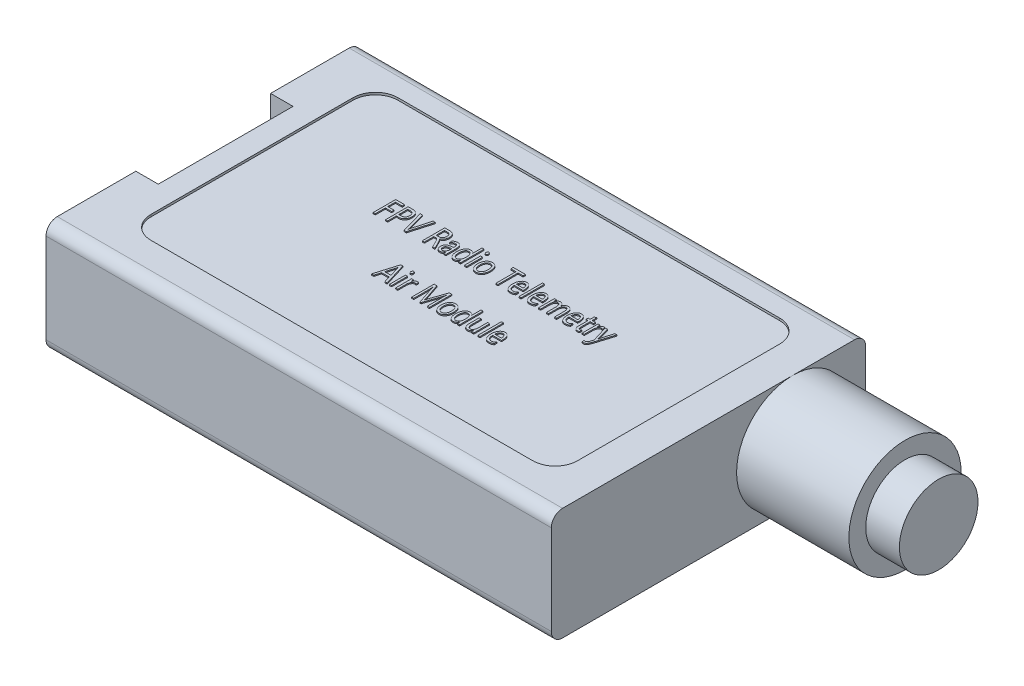
from build123d import *
from OCP.BRepFilletAPI import BRepFilletAPI_MakeChamfer

# Parameters (mm, degrees)
SKETCH1_W           = 45
SKETCH1_H           = 28
BOSS_EXTRUDE1_DEPTH = 10
FILLET1_R           = 1
SKETCH2_W           = 2
SKETCH2_H           = 12
CUT_EXTRUDE1_DEPTH  = 5
SKETCH3_W           = 10
SKETCH3_H           = 3
BOSS_EXTRUDE3_DEPTH = 1
SKETCH4_W           = 9.181146734
SKETCH4_H           = 2.127403256
CUT_EXTRUDE2_DEPTH  = 1
SKETCH7_W           = 0.5
SKETCH7_H           = 1
BOSS_EXTRUDE4_DEPTH = 2
CHAMFER1_SIZE       = 0.1
CHAMFER1_SIZE2      = 0.274747742
CUT_EXTRUDE3_DEPTH  = 0.2
SKETCH10_R          = 5
BOSS_EXTRUDE5_DEPTH = 13
SKETCH11_OUTSIDE_W  = 43.036
SKETCH11_OUTSIDE_H  = 25.036
SKETCH11_OUTSIDE_R  = 3.5
CUT_EXTRUDE4_DEPTH  = 3
SKETCH9_W           = 0.186266448
SKETCH9_H           = 1.421052632
SKETCH9_W_2         = 0.186266447
SKETCH9_H_2         = 2.105263158
SKETCH9_H_3         = 1.421052631
BOSS_EXTRUDE6_DEPTH = 0.1


with BuildPart() as part:
    # Sketch1 → Boss-Extrude1 (new body)
    with BuildSketch(Plane(origin=(0, 0, 0), x_dir=(1, 0, 0), z_dir=(0, 1, 0))):
        Rectangle(SKETCH1_W, SKETCH1_H)
    extrude(amount=BOSS_EXTRUDE1_DEPTH)

    # Fillet1
    fillet1_edges = [part.edges().sort_by_distance(p)[0] for p in [
        (0, 10, 14),
        (0, 0, 14),
        (0, 0, -14),
        (0, 10, -14),
    ]]
    fillet(fillet1_edges, radius=FILLET1_R)

    # Sketch2 → Cut-Extrude1 (cut)
    with BuildSketch(Plane(origin=(0, 10, 0), x_dir=(1, 0, 0), z_dir=(0, 1, 0))):
        with Locations((-21.5, 0)):
            Rectangle(SKETCH2_W, SKETCH2_H)
    extrude(amount=-CUT_EXTRUDE1_DEPTH, mode=Mode.SUBTRACT)

    # Sketch3 → Boss-Extrude3 (add)
    with BuildSketch(Plane.ZY.offset(20.5)):
        with Locations((0.110755926, 6.5)):
            Rectangle(SKETCH3_W, SKETCH3_H)
    extrude(amount=BOSS_EXTRUDE3_DEPTH)

    # Sketch4 → Cut-Extrude2 (cut)
    with BuildSketch(Plane.ZY.offset(21.5)):
        with Locations((0.1, 6.5)):
            Rectangle(SKETCH4_W, SKETCH4_H)
    extrude(amount=-CUT_EXTRUDE2_DEPTH, mode=Mode.SUBTRACT)

    # Sketch7 → Boss-Extrude4 (add)
    with BuildSketch(Plane.ZY.offset(20.5)):
        with Locations((2, 6.2)):
            Rectangle(SKETCH7_W, SKETCH7_H)
        with Locations((0.666666667, 6.2)):
            Rectangle(SKETCH7_W, SKETCH7_H)
        with Locations((-2, 6.2)):
            Rectangle(SKETCH7_W, SKETCH7_H)
        with Locations((-0.66666667, 6.2)):
            Rectangle(SKETCH7_W, SKETCH7_H)
    extrude(amount=BOSS_EXTRUDE4_DEPTH)

    # Chamfer1: one chamfer whose edges measure the first distance from different faces: ONE call of the kernel's chamfer builder (chamfer() names one face for all edges)
    chamfer1_edges_1 = [part.edges().sort_by_distance(p)[0] for p in [
        (-22.5, 6.2, -0.41666667),
        (-22.5, 6.7, -0.66666667),
        (-22.5, 6.2, -0.91666667),
        (-22.5, 5.7, -0.66666667),
    ]]
    chamfer1_side_1 = [part.faces().sort_by_distance(p)[0] for p in [
        (-22.5, 6.2, -0.66666667),
    ]]
    chamfer1_edges_2 = [part.edges().sort_by_distance(p)[0] for p in [
        (-22.5, 6.2, -1.75),
        (-22.5, 6.7, -2),
        (-22.5, 6.2, -2.25),
        (-22.5, 5.7, -2),
    ]]
    chamfer1_side_2 = [part.faces().sort_by_distance(p)[0] for p in [
        (-22.5, 6.2, -2),
    ]]
    chamfer1_edges_3 = [part.edges().sort_by_distance(p)[0] for p in [
        (-22.5, 6.2, 0.916666667),
        (-22.5, 6.7, 0.666666667),
        (-22.5, 6.2, 0.416666667),
        (-22.5, 5.7, 0.666666667),
    ]]
    chamfer1_side_3 = [part.faces().sort_by_distance(p)[0] for p in [
        (-22.5, 6.2, 0.666666667),
    ]]
    chamfer1_edges_4 = [part.edges().sort_by_distance(p)[0] for p in [
        (-22.5, 6.2, 2.25),
        (-22.5, 6.7, 2),
        (-22.5, 6.2, 1.75),
        (-22.5, 5.7, 2),
    ]]
    chamfer1_side_4 = [part.faces().sort_by_distance(p)[0] for p in [
        (-22.5, 6.2, 2),
    ]]
    chamfer1 = BRepFilletAPI_MakeChamfer(part.part.solid().wrapped)
    for e in chamfer1_edges_1:
        chamfer1.Add(CHAMFER1_SIZE, CHAMFER1_SIZE2, e.wrapped, chamfer1_side_1[0].wrapped)  # the first distance lies on this face
    for e in chamfer1_edges_2:
        chamfer1.Add(CHAMFER1_SIZE, CHAMFER1_SIZE2, e.wrapped, chamfer1_side_2[0].wrapped)  # the first distance lies on this face
    for e in chamfer1_edges_3:
        chamfer1.Add(CHAMFER1_SIZE, CHAMFER1_SIZE2, e.wrapped, chamfer1_side_3[0].wrapped)  # the first distance lies on this face
    for e in chamfer1_edges_4:
        chamfer1.Add(CHAMFER1_SIZE, CHAMFER1_SIZE2, e.wrapped, chamfer1_side_4[0].wrapped)  # the first distance lies on this face
    add(Compound.cast(chamfer1.Shape()), mode=Mode.REPLACE)

    # Sketch8 → Cut-Extrude3 (cut)
    with BuildSketch(Plane(origin=(0, 10, 0), x_dir=(1, 0, 0), z_dir=(0, 1, 0))):
        with BuildLine():
            Line((17.5, -10.656590287), (-16.5, -10.656590287))
            ThreePointArc((-16.5, -10.656590287), (-17.914213562, -10.070803849), (-18.5, -8.656590287))
            Line((-18.5, -8.656590287), (-18.5, 9.343409713))
            ThreePointArc((-18.5, 9.343409713), (-17.914213562, 10.757623276), (-16.5, 11.343409713))
            Line((-16.5, 11.343409713), (17.5, 11.343409713))
            ThreePointArc((17.5, 11.343409713), (18.914213562, 10.757623276), (19.5, 9.343409713))
            Line((19.5, 9.343409713), (19.5, -8.656590287))
            ThreePointArc((19.5, -8.656590287), (18.914213562, -10.070803849), (17.5, -10.656590287))
        make_face()
    extrude(amount=-CUT_EXTRUDE3_DEPTH, mode=Mode.SUBTRACT)

    # Sketch10 → Boss-Extrude5 (add)
    with BuildSketch(Plane(origin=(22.5, 0, 0), x_dir=(0, 0, -1), z_dir=(1, 0, 0))):
        with Locations(Location((7.5, 5, 0), (0, 0, 270))):
            Circle(SKETCH10_R)
    extrude(amount=BOSS_EXTRUDE5_DEPTH)

    # Sketch11 outside → Cut-Extrude4 (cut)
    with BuildSketch(Plane(origin=(35.5, 0, 0), x_dir=(0, 0, -1), z_dir=(1, 0, 0))):
        with Locations((0, 5)):
            Rectangle(SKETCH11_OUTSIDE_W, SKETCH11_OUTSIDE_H)
        with Locations((7.5, 5)):
            Circle(SKETCH11_OUTSIDE_R, mode=Mode.SUBTRACT)
    extrude(amount=-CUT_EXTRUDE4_DEPTH, mode=Mode.SUBTRACT)

    # Sketch9 → Boss-Extrude6 (add)
    # profile 1 of 28: a face of its own
    with BuildSketch(Plane(origin=(0, 9.8, 0), x_dir=(1, 0, 0), z_dir=(0, 1, 0))):
        Polygon((-8.055490178, 3.276817672), (-8.658697415, 3.276817672), (-8.658697415, 2.592607145), (-8.108121757, 2.592607145), (-8.108121757, 2.38208083), (-8.658697415, 2.38208083), (-8.658697415, 1.487343987), (-8.844963862, 1.487343987), (-8.844963862, 3.487343987), (-8.055490178, 3.487343987), align=None)
    # profile 2 of 28: a face of its own
    with BuildSketch(Plane(origin=(0, 9.8, 0), x_dir=(1, 0, 0), z_dir=(0, 1, 0))):
        with BuildLine():
            Line((-7.553434257, 2.250501882), (-7.553434257, 1.487343987))
            Line((-7.553434257, 1.487343987), (-7.739700704, 1.487343987))
            Line((-7.739700704, 1.487343987), (-7.739700704, 3.487343987))
            Line((-7.739700704, 3.487343987), (-7.313302678, 3.487343987))
            add(Edge.make_bspline(
                [(-7.313302678, 3.487343987), (-7.293129529, 3.486902444), (-7.253737816, 3.486040251), (-7.196503222, 3.478402394), (-7.142608418, 3.466621697), (-7.092105507, 3.449912227), (-7.045474021, 3.427481066), (-7.002365485, 3.400520972), (-6.962381551, 3.36907421), (-6.926411334, 3.33244373), (-6.894153087, 3.291488616), (-6.866140562, 3.246548769), (-6.84255244, 3.197434202), (-6.82330156, 3.144401937), (-6.808637621, 3.087350994), (-6.798004013, 3.026453495), (-6.791276569, 2.961590554), (-6.790615355, 2.916911429), (-6.790276362, 2.894005172)],
                knots=[0, 0, 0, 0, 1.07717949, 2.103387256, 3.078597666, 4.020931969, 4.937894399, 5.835835056, 6.732311881, 7.648689514, 8.571479536, 9.512105679, 10.471577811, 11.476806693, 12.521009255, 13.613997773, 14.776735654, 16, 16, 16, 16], degree=3))
            add(Edge.make_bspline(
                [(-6.790276362, 2.894005172), (-6.790767667, 2.87096214), (-6.791729216, 2.8258639), (-6.798750778, 2.759703004), (-6.810701597, 2.696758033), (-6.82697393, 2.636794271), (-6.848544136, 2.580311803), (-6.874376749, 2.526856186), (-6.905594044, 2.476963398), (-6.940616697, 2.430153412), (-6.979932217, 2.387844885), (-7.022931873, 2.350952215), (-7.069287499, 2.319843992), (-7.11907795, 2.294675067), (-7.172162645, 2.274828465), (-7.228502068, 2.260394415), (-7.288253038, 2.252193588), (-7.329039982, 2.251074284), (-7.349898072, 2.250501882)],
                knots=[0, 0, 0, 0, 1.152827818, 2.256235508, 3.324144492, 4.355652639, 5.360557, 6.345060727, 7.321313741, 8.300596887, 9.266169561, 10.204872975, 11.129238801, 12.052382795, 12.989857982, 13.959537478, 14.956525106, 16, 16, 16, 16], degree=3))
            Line((-7.349898072, 2.250501882), (-7.553434257, 2.250501882))
        make_face()
        with BuildLine():
            Line((-7.553434257, 3.276817672), (-7.553434257, 2.461028198))
            Line((-7.553434257, 2.461028198), (-7.363055967, 2.461028198))
            add(Edge.make_bspline(
                [(-7.363055967, 2.461028198), (-7.347823899, 2.461283229), (-7.318218609, 2.461778911), (-7.275171701, 2.46737042), (-7.234827447, 2.475866248), (-7.197079028, 2.487672804), (-7.162383448, 2.503436231), (-7.130470307, 2.522406284), (-7.101320822, 2.544888725), (-7.075115393, 2.570722916), (-7.051801955, 2.599857556), (-7.031863457, 2.63202649), (-7.014243284, 2.666827489), (-7.000470004, 2.704701164), (-6.989832605, 2.745338339), (-6.981975926, 2.788623732), (-6.977540665, 2.834839153), (-6.97688162, 2.866583587), (-6.976542809, 2.882903198)],
                knots=[0, 0, 0, 0, 1.12110893, 2.179005138, 3.19062652, 4.154651003, 5.085228385, 5.990556596, 6.882906755, 7.789359598, 8.694181269, 9.62393719, 10.571869491, 11.56185894, 12.585245212, 13.662277243, 14.798191699, 16, 16, 16, 16], degree=3))
            add(Edge.make_bspline(
                [(-6.976542809, 2.882903198), (-6.97668493, 2.898816466), (-6.976961228, 2.929753644), (-6.981798908, 2.97450334), (-6.988492122, 3.016216515), (-6.998404953, 3.054758179), (-7.011137838, 3.090306846), (-7.026660586, 3.122950668), (-7.045383514, 3.152421494), (-7.066747221, 3.178952539), (-7.091194836, 3.202026821), (-7.118331251, 3.222165284), (-7.148461781, 3.238783683), (-7.181247354, 3.253125206), (-7.217114592, 3.263441814), (-7.255576134, 3.271423065), (-7.296891107, 3.275820954), (-7.325354483, 3.276478601), (-7.340029651, 3.276817672)],
                knots=[0, 0, 0, 0, 1.241934846, 2.414460747, 3.510644543, 4.53861071, 5.517020602, 6.455268434, 7.3549368, 8.237508688, 9.1081238, 9.972930345, 10.86902656, 11.789525819, 12.761357301, 13.777273837, 14.854005157, 16, 16, 16, 16], degree=3))
            Line((-7.340029651, 3.276817672), (-7.553434257, 3.276817672))
        make_face(mode=Mode.SUBTRACT)
    # profile 3 of 28: a face of its own
    with BuildSketch(Plane(origin=(0, 9.8, 0), x_dir=(1, 0, 0), z_dir=(0, 1, 0))):
        with BuildLine():
            Line((-5.318648072, 3.487343987), (-5.895128336, 1.487343987))
            Line((-5.895128336, 1.487343987), (-6.096197415, 1.487343987))
            Line((-6.096197415, 1.487343987), (-6.660753336, 3.487343987))
            Line((-6.660753336, 3.487343987), (-6.456394783, 3.487343987))
            Line((-6.456394783, 3.487343987), (-6.026296099, 1.901817672))
            add(Edge.make_bspline(
                [(-6.026296099, 1.901817672), (-6.022842379, 1.888559265), (-6.01572823, 1.861248918), (-6.007936229, 1.818165674), (-6.000238079, 1.772449822), (-5.99680333, 1.740793022), (-5.995046099, 1.724597277)],
                knots=[0, 0, 0, 0, 0.912358094, 1.87932207, 2.915052701, 4, 4, 4, 4], degree=3))
            Line((-5.995046099, 1.724597277), (-5.990934257, 1.724597277))
            add(Edge.make_bspline(
                [(-5.990934257, 1.724597277), (-5.986949135, 1.753623107), (-5.978609991, 1.814361667), (-5.963204647, 1.873709405), (-5.95516123, 1.904695961)],
                knots=[0, 0, 0, 0, 0.955762883, 2, 2, 2, 2], degree=3))
            Line((-5.95516123, 1.904695961), (-5.516427678, 3.487343987))
            Line((-5.516427678, 3.487343987), (-5.318648072, 3.487343987))
        make_face()
    # profile 4 of 28: a face of its own
    with BuildSketch(Plane(origin=(0, 9.8, 0), x_dir=(1, 0, 0), z_dir=(0, 1, 0))):
        with BuildLine():
            Line((-3.344963862, 1.487343987), (-3.563302678, 1.487343987))
            Line((-3.563302678, 1.487343987), (-3.825638204, 2.042442672))
            add(Edge.make_bspline(
                [(-3.825638204, 2.042442672), (-3.837403157, 2.06644824), (-3.859361501, 2.111252716), (-3.894559458, 2.171888576), (-3.928775212, 2.222544628), (-3.964512696, 2.262845853), (-4.001908564, 2.294392416), (-4.04364539, 2.314793746), (-4.089157015, 2.327356743), (-4.121053987, 2.328730938), (-4.13772702, 2.329449251)],
                knots=[0, 0, 0, 0, 1.420880934, 2.651960785, 3.725335783, 4.664545531, 5.508994612, 6.307417012, 7.115261139, 8, 8, 8, 8], degree=3))
            Line((-4.13772702, 2.329449251), (-4.290276362, 2.329449251))
            Line((-4.290276362, 2.329449251), (-4.290276362, 1.487343987))
            Line((-4.290276362, 1.487343987), (-4.476542809, 1.487343987))
            Line((-4.476542809, 1.487343987), (-4.476542809, 3.487343987))
            Line((-4.476542809, 3.487343987), (-4.007381625, 3.487343987))
            add(Edge.make_bspline(
                [(-4.007381625, 3.487343987), (-3.990505472, 3.486954801), (-3.957322371, 3.486189556), (-3.908412311, 3.479960883), (-3.861676907, 3.469206359), (-3.816908383, 3.454768175), (-3.774436359, 3.436587356), (-3.735149877, 3.413042487), (-3.698221241, 3.386087562), (-3.664921973, 3.353961583), (-3.634274491, 3.31824844), (-3.607435957, 3.277841715), (-3.584083491, 3.233452412), (-3.564371066, 3.184965995), (-3.547965108, 3.132549406), (-3.537410612, 3.075395854), (-3.530013836, 3.01412804), (-3.529459651, 2.971743388), (-3.529174388, 2.949926224)],
                knots=[0, 0, 0, 0, 0.994849099, 1.956143566, 2.90109523, 3.818589122, 4.72696168, 5.618167909, 6.513614521, 7.416795512, 8.339825076, 9.283462625, 10.270369282, 11.292387266, 12.366045167, 13.502441576, 14.714401606, 16, 16, 16, 16], degree=3))
            add(Edge.make_bspline(
                [(-3.529174388, 2.949926224), (-3.529518663, 2.932784819), (-3.530194657, 2.899127127), (-3.534670521, 2.849642628), (-3.542557696, 2.80227355), (-3.553150058, 2.757039641), (-3.566673869, 2.714112328), (-3.583303655, 2.673670747), (-3.602140567, 2.635408287), (-3.623391578, 2.599500791), (-3.647655486, 2.566584805), (-3.673278716, 2.535348737), (-3.702360295, 2.507572829), (-3.733243231, 2.481963141), (-3.766148265, 2.458821393), (-3.801176349, 2.438767689), (-3.838120492, 2.421167719), (-3.863927547, 2.411880504), (-3.87703623, 2.407163066)],
                knots=[0, 0, 0, 0, 1.189204483, 2.335040694, 3.443373236, 4.51815857, 5.555660659, 6.562153824, 7.548731529, 8.512500464, 9.452089987, 10.383464044, 11.311434123, 12.236720863, 13.165275367, 14.098201392, 15.033982111, 16, 16, 16, 16], degree=3))
            Line((-3.87703623, 2.407163066), (-3.87703623, 2.401406487))
            add(Edge.make_bspline(
                [(-3.87703623, 2.401406487), (-3.864175981, 2.393819439), (-3.839309631, 2.379149257), (-3.806570535, 2.351337384), (-3.776920194, 2.320040995), (-3.749714973, 2.283519787), (-3.722696732, 2.242093082), (-3.69665531, 2.19446389), (-3.668346106, 2.140835329), (-3.649167795, 2.102650535), (-3.638960572, 2.08232754)],
                knots=[0, 0, 0, 0, 0.883747176, 1.708797903, 2.536525362, 3.435275291, 4.40444207, 5.466795008, 6.651758785, 8, 8, 8, 8], degree=3))
            Line((-3.638960572, 2.08232754), (-3.344963862, 1.487343987))
        make_face()
        with BuildLine():
            Line((-4.290276362, 3.276817672), (-4.290276362, 2.539975566))
            Line((-4.290276362, 2.539975566), (-4.038220441, 2.539975566))
            add(Edge.make_bspline(
                [(-4.038220441, 2.539975566), (-4.026830743, 2.540298903), (-4.004353075, 2.540937012), (-3.971303355, 2.545773305), (-3.939801499, 2.554847765), (-3.909189133, 2.565977733), (-3.880726454, 2.581356219), (-3.853838797, 2.599198604), (-3.829377785, 2.620268487), (-3.806388072, 2.643859745), (-3.785880349, 2.670658258), (-3.767855347, 2.700366439), (-3.752089688, 2.73268831), (-3.739029321, 2.767828139), (-3.728253986, 2.805445012), (-3.721075218, 2.845543092), (-3.716412674, 2.887590766), (-3.715769367, 2.916333221), (-3.715440836, 2.931011751)],
                knots=[0, 0, 0, 0, 0.960585261, 1.895723298, 2.807197773, 3.721818931, 4.637097328, 5.528409847, 6.438710686, 7.354354012, 8.302336297, 9.277761727, 10.280745444, 11.330661867, 12.435827, 13.576280124, 14.76222671, 16, 16, 16, 16], degree=3))
            add(Edge.make_bspline(
                [(-3.715440836, 2.931011751), (-3.715613216, 2.944184375), (-3.715949901, 2.969912587), (-3.720448066, 3.007366562), (-3.726233081, 3.042802194), (-3.735240369, 3.075918163), (-3.747453571, 3.106408798), (-3.761269792, 3.135165676), (-3.778213176, 3.161444048), (-3.797592456, 3.185504705), (-3.819551119, 3.206826798), (-3.843336368, 3.226073705), (-3.870032605, 3.241745891), (-3.89899162, 3.254300188), (-3.929962072, 3.264952228), (-3.963456586, 3.271453034), (-3.999010077, 3.276424017), (-4.023535106, 3.276683862), (-4.03616452, 3.276817672)],
                knots=[0, 0, 0, 0, 1.177802918, 2.300434767, 3.37095633, 4.388398818, 5.363040267, 6.306319392, 7.238372421, 8.153821012, 9.064328317, 9.972106452, 10.884840646, 11.823645442, 12.793104443, 13.808031252, 14.871223285, 16, 16, 16, 16], degree=3))
            Line((-4.03616452, 3.276817672), (-4.290276362, 3.276817672))
        make_face(mode=Mode.SUBTRACT)
    # profile 5 of 28: a face of its own
    with BuildSketch(Plane(origin=(0, 9.8, 0), x_dir=(1, 0, 0), z_dir=(0, 1, 0))):
        with BuildLine():
            Line((-2.36922373, 1.487343987), (-2.555490178, 1.487343987))
            Line((-2.555490178, 1.487343987), (-2.555490178, 1.708972277))
            Line((-2.555490178, 1.708972277), (-2.55960202, 1.708972277))
            add(Edge.make_bspline(
                [(-2.55960202, 1.708972277), (-2.569209561, 1.689433698), (-2.5877287, 1.651771858), (-2.620942462, 1.600712184), (-2.658383731, 1.558051753), (-2.698451494, 1.522268777), (-2.742566334, 1.49476614), (-2.790143832, 1.475411271), (-2.840887022, 1.462802284), (-2.876000703, 1.461627084), (-2.893894783, 1.461028198)],
                knots=[0, 0, 0, 0, 1.180832366, 2.276128618, 3.293377247, 4.252557378, 5.181208823, 6.098263094, 7.030866834, 8, 8, 8, 8], degree=3))
            add(Edge.make_bspline(
                [(-2.893894783, 1.461028198), (-2.907072505, 1.461293194), (-2.93285749, 1.461811714), (-2.970316845, 1.467340301), (-3.005583186, 1.475966164), (-3.038795141, 1.487844523), (-3.069670627, 1.503549001), (-3.09843422, 1.522665465), (-3.124759041, 1.545361539), (-3.148634008, 1.571404148), (-3.169950379, 1.60031104), (-3.188943052, 1.631420352), (-3.204665788, 1.665112495), (-3.217175116, 1.70101434), (-3.227820881, 1.738969031), (-3.234317552, 1.779392783), (-3.239295526, 1.821924689), (-3.239563354, 1.851088565), (-3.239700704, 1.866044645)],
                knots=[0, 0, 0, 0, 1.050826955, 2.056163942, 3.013727729, 3.944369582, 4.863891948, 5.770840848, 6.693739049, 7.630274343, 8.583958045, 9.555534193, 10.534041278, 11.544126046, 12.586782793, 13.674578426, 14.807456489, 16, 16, 16, 16], degree=3))
            add(Edge.make_bspline(
                [(-3.239700704, 1.866044645), (-3.239557204, 1.881958113), (-3.239276993, 1.913032134), (-3.234380361, 1.958317511), (-3.227691849, 2.001255739), (-3.217705133, 2.041479007), (-3.20559459, 2.079375373), (-3.189717676, 2.114290451), (-3.171684559, 2.147057859), (-3.150708988, 2.177200797), (-3.126612034, 2.204548151), (-3.09975868, 2.229189869), (-3.070315037, 2.251730902), (-3.037863379, 2.271314549), (-3.002572101, 2.288263459), (-2.964693875, 2.302511708), (-2.924058339, 2.314689669), (-2.895732325, 2.320361318), (-2.881148072, 2.323281487)],
                knots=[0, 0, 0, 0, 1.18808402, 2.319956101, 3.398910915, 4.431952644, 5.412997736, 6.366295286, 7.292146019, 8.203906091, 9.103512676, 10.00921639, 10.922527319, 11.868982405, 12.835223092, 13.843044208, 14.889445333, 16, 16, 16, 16], degree=3))
            Line((-2.881148072, 2.323281487), (-2.555490178, 2.38208083))
            add(Edge.make_bspline(
                [(-2.555490178, 2.38208083), (-2.555576784, 2.39702854), (-2.555743818, 2.425857771), (-2.559029986, 2.467654473), (-2.562637283, 2.506581715), (-2.569102152, 2.542622213), (-2.576454216, 2.575903211), (-2.586771423, 2.606045837), (-2.597330992, 2.633793795), (-2.610919939, 2.658197993), (-2.625358781, 2.680304598), (-2.642682175, 2.698828752), (-2.660973084, 2.715179436), (-2.681611583, 2.727853471), (-2.703368726, 2.73848676), (-2.72733947, 2.745197744), (-2.752796231, 2.750076924), (-2.770513912, 2.750357979), (-2.779585572, 2.750501882)],
                knots=[0, 0, 0, 0, 1.474387982, 2.84361078, 4.135509969, 5.329477152, 6.454672652, 7.493927693, 8.470859448, 9.378595505, 10.24509591, 11.068408765, 11.873753001, 12.657924482, 13.450448321, 14.25488359, 15.106479928, 16, 16, 16, 16], degree=3))
            add(Edge.make_bspline(
                [(-2.779585572, 2.750501882), (-2.795797195, 2.749955954), (-2.828041359, 2.748870129), (-2.875695605, 2.739885785), (-2.922161709, 2.725323552), (-2.967508033, 2.705181836), (-3.011415933, 2.678762403), (-3.054234035, 2.647110151), (-3.095616327, 2.609282023), (-3.121239205, 2.580907215), (-3.134437546, 2.566291356)],
                knots=[0, 0, 0, 0, 0.941501078, 1.872601878, 2.807204924, 3.766329387, 4.748459901, 5.779127368, 6.856028829, 8, 8, 8, 8], degree=3))
            Line((-3.134437546, 2.566291356), (-3.134437546, 2.800666356))
            add(Edge.make_bspline(
                [(-3.134437546, 2.800666356), (-3.120753334, 2.811301485), (-3.093584644, 2.832416512), (-3.050453883, 2.85993165), (-3.005697272, 2.88308956), (-2.959555602, 2.902250364), (-2.911500308, 2.916408085), (-2.862097007, 2.927359405), (-2.810992016, 2.933513175), (-2.776448514, 2.93431035), (-2.759026362, 2.934712409)],
                knots=[0, 0, 0, 0, 1.021785952, 2.028657811, 3.012087166, 3.990854113, 4.970321836, 5.962878648, 6.972569748, 8, 8, 8, 8], degree=3))
            add(Edge.make_bspline(
                [(-2.759026362, 2.934712409), (-2.743242653, 2.934346434), (-2.712643628, 2.933636938), (-2.668267396, 2.927336131), (-2.626885473, 2.917119806), (-2.588416846, 2.902806849), (-2.553116857, 2.884040981), (-2.520624921, 2.861429536), (-2.491895713, 2.833862096), (-2.465706387, 2.802793053), (-2.44261602, 2.767629236), (-2.422829364, 2.728287677), (-2.406563422, 2.684599538), (-2.392564322, 2.637110055), (-2.381932186, 2.585393071), (-2.374746672, 2.529587528), (-2.37018803, 2.469738403), (-2.369551245, 2.428416177), (-2.36922373, 2.407163066)],
                knots=[0, 0, 0, 0, 1.012957619, 1.963766393, 2.870851017, 3.745290779, 4.591648972, 5.431531772, 6.278164414, 7.140116636, 8.035861183, 8.972515037, 9.961293571, 11.025040129, 12.148585099, 13.347100411, 14.635543796, 16, 16, 16, 16], degree=3))
            Line((-2.36922373, 2.407163066), (-2.36922373, 1.487343987))
        make_face()
        with BuildLine():
            Line((-2.555490178, 2.197870303), (-2.813302678, 2.151406487))
            add(Edge.make_bspline(
                [(-2.813302678, 2.151406487), (-2.832032311, 2.147392879), (-2.867508338, 2.139790654), (-2.916899952, 2.123176722), (-2.958479385, 2.101323869), (-2.988409192, 2.079763411), (-3.0075427, 2.058958524), (-3.01996424, 2.040984763), (-3.030824298, 2.020395049), (-3.038698734, 1.996684615), (-3.045289717, 1.970710419), (-3.050252298, 1.942135751), (-3.053085676, 1.910922151), (-3.053315306, 1.889213976), (-3.053434257, 1.877968987)],
                knots=[0, 0, 0, 0, 1.686143257, 3.193744372, 4.570298242, 5.810953059, 6.41738945, 7.050153698, 7.730288207, 8.459311652, 9.243766443, 10.08899482, 11.010085798, 12, 12, 12, 12], degree=3))
            add(Edge.make_bspline(
                [(-3.053434257, 1.877968987), (-3.052696207, 1.861609962), (-3.051272577, 1.830054905), (-3.041140198, 1.784872722), (-3.022976916, 1.7447533), (-2.99890138, 1.709467027), (-2.96837259, 1.68077303), (-2.93242682, 1.660243685), (-2.892014459, 1.647332043), (-2.863429958, 1.64595173), (-2.84866452, 1.645238724)],
                knots=[0, 0, 0, 0, 1.128255088, 2.176300453, 3.170783809, 4.149001312, 5.105552382, 6.033118205, 6.983999316, 8, 8, 8, 8], degree=3))
            add(Edge.make_bspline(
                [(-2.84866452, 1.645238724), (-2.838213878, 1.64545901), (-2.817691141, 1.645891601), (-2.787807022, 1.652166705), (-2.759223192, 1.66096463), (-2.732192567, 1.674016459), (-2.706501864, 1.690590071), (-2.682314553, 1.710979703), (-2.658933044, 1.734484131), (-2.637893088, 1.762046169), (-2.618783452, 1.792257209), (-2.601762111, 1.824527446), (-2.587390321, 1.858804022), (-2.575464525, 1.894933592), (-2.566313283, 1.933027162), (-2.560509435, 1.973097006), (-2.556004535, 2.015066834), (-2.555664096, 2.043800062), (-2.555490178, 2.058478856)],
                knots=[0, 0, 0, 0, 0.888897848, 1.745597747, 2.591480801, 3.432592811, 4.294373258, 5.190150631, 6.123443675, 7.114030639, 8.137935286, 9.167155502, 10.2192508, 11.301451294, 12.406294287, 13.552706751, 14.749764038, 16, 16, 16, 16], degree=3))
            Line((-2.555490178, 2.058478856), (-2.555490178, 2.197870303))
        make_face(mode=Mode.SUBTRACT)
    # profile 6 of 28: a face of its own
    with BuildSketch(Plane(origin=(0, 9.8, 0), x_dir=(1, 0, 0), z_dir=(0, 1, 0))):
        with BuildLine():
            Line((-1.079750046, 1.487343987), (-1.266016494, 1.487343987))
            Line((-1.266016494, 1.487343987), (-1.266016494, 1.728297935))
            Line((-1.266016494, 1.728297935), (-1.27053952, 1.728297935))
            add(Edge.make_bspline(
                [(-1.27053952, 1.728297935), (-1.281009871, 1.707184563), (-1.301218793, 1.66643345), (-1.338610547, 1.611773663), (-1.379707719, 1.56501744), (-1.425739095, 1.527062358), (-1.475683101, 1.496818374), (-1.530585512, 1.476525042), (-1.589106002, 1.463072228), (-1.629699188, 1.461720154), (-1.65047373, 1.461028198)],
                knots=[0, 0, 0, 0, 1.144013584, 2.208071089, 3.20808541, 4.158916723, 5.09668887, 6.030574157, 6.992098817, 8, 8, 8, 8], degree=3))
            add(Edge.make_bspline(
                [(-1.65047373, 1.461028198), (-1.667377723, 1.461518602), (-1.700616482, 1.462482897), (-1.749085431, 1.471972704), (-1.795064, 1.486614766), (-1.838298686, 1.50768807), (-1.879349128, 1.533802445), (-1.916853465, 1.567144397), (-1.952537983, 1.605391103), (-1.984672833, 1.649949657), (-2.013883491, 1.699340942), (-2.039335119, 1.753300661), (-2.060710262, 1.811521953), (-2.077892621, 1.874006864), (-2.09132275, 1.940656692), (-2.101227851, 2.011630412), (-2.106891315, 2.086894957), (-2.107704748, 2.138513288), (-2.108121757, 2.164975566)],
                knots=[0, 0, 0, 0, 0.864487209, 1.699863589, 2.518690329, 3.328416527, 4.155619005, 5.001218109, 5.890053131, 6.82899447, 7.8073813, 8.824361835, 9.878897677, 10.978687463, 12.138786186, 13.357402439, 14.645265165, 16, 16, 16, 16], degree=3))
            add(Edge.make_bspline(
                [(-2.108121757, 2.164975566), (-2.107791507, 2.193362317), (-2.10714761, 2.248708888), (-2.100271252, 2.329551565), (-2.089887634, 2.406240785), (-2.074681197, 2.478494084), (-2.055457077, 2.546490302), (-2.031451206, 2.609931837), (-2.00372424, 2.669470377), (-1.971149147, 2.723894524), (-1.9357753, 2.773508448), (-1.896500661, 2.816332949), (-1.85474898, 2.853221407), (-1.809655866, 2.882864249), (-1.761899852, 2.906288389), (-1.711117133, 2.922795046), (-1.657453672, 2.932888024), (-1.620638501, 2.934098212), (-1.601953994, 2.934712409)],
                knots=[0, 0, 0, 0, 1.32578413, 2.584924449, 3.787440431, 4.938981395, 6.031325869, 7.084985022, 8.104633414, 9.095116727, 10.04414895, 10.946047301, 11.803771268, 12.640200034, 13.459194065, 14.28126088, 15.127702154, 16, 16, 16, 16], degree=3))
            add(Edge.make_bspline(
                [(-1.601953994, 2.934712409), (-1.583526117, 2.934205453), (-1.547705723, 2.933220026), (-1.496105229, 2.921954278), (-1.448185125, 2.904762954), (-1.403964835, 2.880291518), (-1.3642906, 2.848107818), (-1.328594891, 2.809233926), (-1.296609259, 2.763608387), (-1.279430781, 2.729502921), (-1.27053952, 2.711850566)],
                knots=[0, 0, 0, 0, 1.039860284, 2.021296712, 2.969680078, 3.909419061, 4.862724865, 5.843947276, 6.884067204, 8, 8, 8, 8], degree=3))
            Line((-1.27053952, 2.711850566), (-1.266016494, 2.711850566))
            Line((-1.266016494, 2.711850566), (-1.266016494, 3.592607145))
            Line((-1.266016494, 3.592607145), (-1.079750046, 3.592607145))
            Line((-1.079750046, 3.592607145), (-1.079750046, 1.487343987))
        make_face()
        with BuildLine():
            Line((-1.266016494, 2.130024909), (-1.266016494, 2.339317672))
            add(Edge.make_bspline(
                [(-1.266016494, 2.339317672), (-1.266212798, 2.353444639), (-1.266596769, 2.381076867), (-1.270811864, 2.421776514), (-1.277926099, 2.460735365), (-1.286943254, 2.498367928), (-1.300335538, 2.533753073), (-1.314549574, 2.568191941), (-1.333218848, 2.600257419), (-1.353309471, 2.630890294), (-1.375786667, 2.658822918), (-1.400116042, 2.683140504), (-1.425758936, 2.704025426), (-1.453104822, 2.721049385), (-1.482020971, 2.734192379), (-1.512334221, 2.743916012), (-1.5442099, 2.749123799), (-1.565890103, 2.750038539), (-1.576871757, 2.750501882)],
                knots=[0, 0, 0, 0, 1.183135612, 2.314203207, 3.422309147, 4.500017181, 5.549652335, 6.588429772, 7.616683636, 8.651646701, 9.655835786, 10.613868139, 11.528391394, 12.420512376, 13.3042446, 14.183040152, 15.07965696, 16, 16, 16, 16], degree=3))
            add(Edge.make_bspline(
                [(-1.576871757, 2.750501882), (-1.589924479, 2.750013553), (-1.615536579, 2.74905535), (-1.652918447, 2.741922764), (-1.688188366, 2.730083535), (-1.721009079, 2.712702481), (-1.752106782, 2.691385695), (-1.780700422, 2.664718906), (-1.806463533, 2.632945185), (-1.830849542, 2.597412126), (-1.851933978, 2.557204153), (-1.871117671, 2.513660873), (-1.886360343, 2.465989833), (-1.899817669, 2.415019504), (-1.909193378, 2.36021108), (-1.916932937, 2.301953217), (-1.920711257, 2.239997216), (-1.921467687, 2.197462605), (-1.921855309, 2.175666356)],
                knots=[0, 0, 0, 0, 0.838086226, 1.644495912, 2.435228699, 3.218871335, 4.022392035, 4.850990187, 5.720133833, 6.645645243, 7.614651311, 8.6320093, 9.698362047, 10.825877654, 12.015777686, 13.267275414, 14.599654667, 16, 16, 16, 16], degree=3))
            add(Edge.make_bspline(
                [(-1.921855309, 2.175666356), (-1.921667838, 2.155647438), (-1.92130402, 2.116797645), (-1.917074952, 2.060106239), (-1.910266065, 2.006665887), (-1.900305449, 1.956443332), (-1.888171384, 1.909355001), (-1.872865008, 1.865501624), (-1.854920306, 1.824886593), (-1.834328259, 1.787698349), (-1.811524901, 1.754317228), (-1.786175617, 1.72546906), (-1.759619234, 1.700280419), (-1.73035252, 1.680592906), (-1.699731554, 1.664506066), (-1.666800862, 1.653603127), (-1.632168105, 1.646145887), (-1.608299267, 1.645543927), (-1.596197415, 1.645238724)],
                knots=[0, 0, 0, 0, 1.386261493, 2.690253959, 3.934842923, 5.115178193, 6.234218017, 7.300009057, 8.328449608, 9.305807384, 10.240608748, 11.12202177, 11.961757849, 12.76748406, 13.557168693, 14.349701099, 15.163274123, 16, 16, 16, 16], degree=3))
            add(Edge.make_bspline(
                [(-1.596197415, 1.645238724), (-1.584238078, 1.645578528), (-1.560678344, 1.646247935), (-1.526309599, 1.653212961), (-1.493416654, 1.663759677), (-1.462650998, 1.679253371), (-1.433181894, 1.698293299), (-1.406196764, 1.722508166), (-1.380614335, 1.750637464), (-1.356887102, 1.782575558), (-1.335752639, 1.817986586), (-1.316610854, 1.855742968), (-1.301149141, 1.896209412), (-1.28853475, 1.938738119), (-1.277916465, 1.983279433), (-1.271411513, 2.030238586), (-1.266430384, 2.079342923), (-1.266156521, 2.11287819), (-1.266016494, 2.130024909)],
                knots=[0, 0, 0, 0, 0.879123035, 1.731860766, 2.570882578, 3.414561458, 4.259566214, 5.14595247, 6.074287606, 7.054870483, 8.068723622, 9.106388691, 10.166755673, 11.251883855, 12.370220705, 13.532994251, 14.738609903, 16, 16, 16, 16], degree=3))
        make_face(mode=Mode.SUBTRACT)
    # profile 7 of 28: a face of its own
    with BuildSketch(Plane(origin=(0, 9.8, 0), x_dir=(1, 0, 0), z_dir=(0, 1, 0))):
        with BuildLine():
            add(Edge.make_bspline(
                [(-0.62703623, 3.276817672), (-0.634506006, 3.277258981), (-0.649458199, 3.278142347), (-0.670794048, 3.286392953), (-0.690137231, 3.299762837), (-0.707744687, 3.317237994), (-0.721925597, 3.339030866), (-0.732388559, 3.363793193), (-0.738644711, 3.391368227), (-0.73933968, 3.410693193), (-0.739700704, 3.420732145)],
                knots=[0, 0, 0, 0, 0.880794716, 1.763080032, 2.662329671, 3.648155012, 4.677792795, 5.716578577, 6.813806042, 8, 8, 8, 8], degree=3))
            add(Edge.make_bspline(
                [(-0.739700704, 3.420732145), (-0.7393441, 3.430772631), (-0.738657637, 3.45010055), (-0.732313973, 3.477779031), (-0.72193762, 3.502827489), (-0.707760035, 3.525034355), (-0.690134441, 3.542871478), (-0.670918536, 3.556767388), (-0.649445608, 3.564947038), (-0.634501811, 3.565843503), (-0.62703623, 3.566291356)],
                knots=[0, 0, 0, 0, 1.178943508, 2.269464319, 3.31675483, 4.353582138, 5.344840249, 6.247696555, 7.124589022, 8, 8, 8, 8], degree=3))
            add(Edge.make_bspline(
                [(-0.62703623, 3.566291356), (-0.619294142, 3.565859137), (-0.603941667, 3.565002051), (-0.58195955, 3.556762927), (-0.562311366, 3.543025382), (-0.544698616, 3.524908297), (-0.530100866, 3.502869993), (-0.51920394, 3.477866385), (-0.512975345, 3.450090897), (-0.512270701, 3.430769331), (-0.511904651, 3.420732145)],
                knots=[0, 0, 0, 0, 0.898952798, 1.782613494, 2.690168907, 3.67215026, 4.708042263, 5.75177462, 6.832089716, 8, 8, 8, 8], degree=3))
            add(Edge.make_bspline(
                [(-0.511904651, 3.420732145), (-0.512269216, 3.411101805), (-0.51297526, 3.392450964), (-0.519366434, 3.365427385), (-0.530057459, 3.340612313), (-0.544869157, 3.318658043), (-0.562016603, 3.29997476), (-0.582203, 3.286947501), (-0.603827568, 3.277961719), (-0.619272119, 3.277200396), (-0.62703623, 3.276817672)],
                knots=[0, 0, 0, 0, 1.130127017, 2.188688953, 3.241724395, 4.286849599, 5.28916395, 6.195843397, 7.093034579, 8, 8, 8, 8], degree=3))
        make_face()
    # profile 8 of 28: a face of its own
    with BuildSketch(Plane(origin=(0, 9.8, 0), x_dir=(1, 0, 0), z_dir=(0, 1, 0))):
        with Locations((-0.620251691, 2.197870303)):
            Rectangle(SKETCH9_W, SKETCH9_H)
    # profile 9 of 28: a face of its own
    with BuildSketch(Plane(origin=(0, 9.8, 0), x_dir=(1, 0, 0), z_dir=(0, 1, 0))):
        with BuildLine():
            add(Edge.make_bspline(
                [(0.307174296, 1.461028198), (0.286860295, 1.461712035), (0.24712289, 1.463049729), (0.189048436, 1.4720026), (0.134428418, 1.487999846), (0.082473243, 1.509133662), (0.034232677, 1.537691053), (-0.01154675, 1.571423165), (-0.053392753, 1.612149811), (-0.092056557, 1.658324405), (-0.126957164, 1.70947875), (-0.156699504, 1.765435825), (-0.183134446, 1.824675298), (-0.20320648, 1.888567912), (-0.219970086, 1.956058479), (-0.231091622, 2.027757195), (-0.23830396, 2.103287232), (-0.239227522, 2.15495249), (-0.239700704, 2.181422935)],
                knots=[0, 0, 0, 0, 0.960676289, 1.879234997, 2.76955216, 3.647060389, 4.52418553, 5.413463982, 6.33028308, 7.278015337, 8.257787089, 9.252537546, 10.271303074, 11.320760986, 12.414903172, 13.557209382, 14.748448037, 16, 16, 16, 16], degree=3))
            add(Edge.make_bspline(
                [(-0.239700704, 2.181422935), (-0.239270419, 2.210224439), (-0.23843497, 2.266145979), (-0.230733212, 2.347567496), (-0.21908492, 2.424285462), (-0.202398741, 2.496263595), (-0.180530857, 2.563419048), (-0.153787351, 2.625604693), (-0.122584492, 2.683243809), (-0.086240704, 2.735439058), (-0.046244445, 2.782562417), (-0.001716972, 2.822994157), (0.045563484, 2.857944964), (0.096763879, 2.886144748), (0.151344506, 2.907947828), (0.209261751, 2.923685942), (0.270570754, 2.932698585), (0.312490516, 2.934031576), (0.33390127, 2.934712409)],
                knots=[0, 0, 0, 0, 1.295230053, 2.514842923, 3.675433129, 4.783566469, 5.834429029, 6.84797001, 7.824670336, 8.777255747, 9.704095488, 10.59865126, 11.47665246, 12.343149252, 13.220110834, 14.114475378, 15.036957751, 16, 16, 16, 16], degree=3))
            add(Edge.make_bspline(
                [(0.33390127, 2.934712409), (0.35436001, 2.93422577), (0.394256186, 2.933276785), (0.452340524, 2.923944753), (0.506956497, 2.908910295), (0.557945325, 2.887201701), (0.605703928, 2.859924658), (0.649971269, 2.826393155), (0.690524793, 2.786435565), (0.727264575, 2.740688781), (0.760774204, 2.690059415), (0.789557353, 2.634178845), (0.813670854, 2.573663672), (0.833391424, 2.508564055), (0.84904158, 2.438905655), (0.859906442, 2.364407751), (0.866612169, 2.285302709), (0.86727715, 2.231053094), (0.867618375, 2.203215698)],
                knots=[0, 0, 0, 0, 0.961474962, 1.874952932, 2.758584105, 3.619350249, 4.474012965, 5.339040293, 6.223305997, 7.144415948, 8.093714346, 9.073912414, 10.094906679, 11.153128048, 12.269656482, 13.449245024, 14.691117368, 16, 16, 16, 16], degree=3))
            add(Edge.make_bspline(
                [(0.867618375, 2.203215698), (0.86712897, 2.175789792), (0.866175419, 2.122353477), (0.859222541, 2.044289448), (0.847208552, 1.970552639), (0.831154217, 1.900650001), (0.808993722, 1.835268786), (0.78329612, 1.773551475), (0.752465964, 1.716135093), (0.716518896, 1.663690563), (0.677482106, 1.615732934), (0.634089187, 1.57448761), (0.587495797, 1.539586411), (0.538014118, 1.510471042), (0.484910309, 1.488105567), (0.428496384, 1.472620397), (0.368913329, 1.462891004), (0.328045823, 1.461657939), (0.307174296, 1.461028198)],
                knots=[0, 0, 0, 0, 1.260605498, 2.456149094, 3.59858796, 4.692737608, 5.748654473, 6.767845797, 7.762917361, 8.737982914, 9.686617105, 10.600145096, 11.482172122, 12.357422912, 13.232673701, 14.122318069, 15.041045218, 16, 16, 16, 16], degree=3))
        make_face()
        with BuildLine():
            add(Edge.make_bspline(
                [(0.320332191, 2.750501882), (0.306321231, 2.750017416), (0.278806385, 2.749066016), (0.238759469, 2.741898776), (0.200796157, 2.730443252), (0.165235413, 2.713720741), (0.131749863, 2.692682378), (0.10054121, 2.666936158), (0.072229188, 2.636072532), (0.04586978, 2.601207325), (0.022554653, 2.561940504), (0.002006326, 2.519170365), (-0.015347873, 2.472799994), (-0.029068566, 2.422920745), (-0.040308964, 2.369672025), (-0.047969339, 2.31277796), (-0.052436641, 2.252356089), (-0.053096164, 2.210898864), (-0.053434257, 2.189646619)],
                knots=[0, 0, 0, 0, 0.89024961, 1.748279925, 2.577835424, 3.404227732, 4.238209749, 5.086049161, 5.967601078, 6.894652742, 7.859935618, 8.865357738, 9.907557592, 11.002645168, 12.150961262, 13.364680864, 14.649054569, 16, 16, 16, 16], degree=3))
            add(Edge.make_bspline(
                [(-0.053434257, 2.189646619), (-0.053088953, 2.169080865), (-0.052418194, 2.129131454), (-0.048070487, 2.070721563), (-0.039782088, 2.015813258), (-0.028669118, 1.964176492), (-0.014980842, 1.915715838), (0.002933005, 1.870886371), (0.023402786, 1.829048022), (0.047122755, 1.79078882), (0.073863681, 1.756845389), (0.102333048, 1.726740764), (0.133272456, 1.70131772), (0.166934721, 1.681333864), (0.202098066, 1.664964255), (0.239524847, 1.653282948), (0.279263588, 1.646818675), (0.306466611, 1.645772147), (0.320332191, 1.645238724)],
                knots=[0, 0, 0, 0, 1.334597753, 2.592484324, 3.797503045, 4.934912321, 6.018576881, 7.06075041, 8.06311041, 9.03794405, 9.975592339, 10.862558729, 11.722398754, 12.564389347, 13.396171324, 14.234489812, 15.100106487, 16, 16, 16, 16], degree=3))
            add(Edge.make_bspline(
                [(0.320332191, 1.645238724), (0.334487048, 1.645521432), (0.36202428, 1.646071419), (0.401962993, 1.653615599), (0.439544822, 1.664357987), (0.474507785, 1.680266523), (0.506891833, 1.700571613), (0.536549732, 1.725528872), (0.564081095, 1.754615797), (0.588628002, 1.788431063), (0.610118285, 1.826447882), (0.629860794, 1.86772884), (0.645576007, 1.913201079), (0.658745644, 1.962258257), (0.668937794, 2.015167483), (0.676323288, 2.071731259), (0.680254682, 2.132162492), (0.680978433, 2.173605293), (0.681351928, 2.194992014)],
                knots=[0, 0, 0, 0, 0.916649125, 1.783273422, 2.627030047, 3.446558928, 4.265364376, 5.098471722, 5.953669322, 6.856858652, 7.800646875, 8.78283538, 9.820266561, 10.915639981, 12.07493559, 13.312013889, 14.612854179, 16, 16, 16, 16], degree=3))
            add(Edge.make_bspline(
                [(0.681351928, 2.194992014), (0.680975825, 2.216652474), (0.680246735, 2.258642227), (0.676355588, 2.319762472), (0.668886121, 2.376998162), (0.658795671, 2.43047169), (0.64559053, 2.480076182), (0.629744275, 2.526030158), (0.610321767, 2.567874997), (0.588651071, 2.60610764), (0.563805329, 2.639906993), (0.536836583, 2.66978921), (0.50687209, 2.694758964), (0.474411078, 2.714976564), (0.43965487, 2.731489857), (0.401947745, 2.742090936), (0.362028395, 2.749678381), (0.334488445, 2.750222296), (0.320332191, 2.750501882)],
                knots=[0, 0, 0, 0, 1.395187653, 2.704632544, 3.941896678, 5.110495436, 6.206809324, 7.245379458, 8.236771903, 9.174023439, 10.07095727, 10.933162384, 11.76049962, 12.573634012, 13.391164791, 14.229077549, 15.089699597, 16, 16, 16, 16], degree=3))
        make_face(mode=Mode.SUBTRACT)
    # profile 10 of 28: a face of its own
    with BuildSketch(Plane(origin=(0, 9.8, 0), x_dir=(1, 0, 0), z_dir=(0, 1, 0))):
        Polygon((2.709723638, 3.276817672), (2.262355217, 3.276817672), (2.262355217, 1.487343987), (2.07608877, 1.487343987), (2.07608877, 3.276817672), (1.628720349, 3.276817672), (1.628720349, 3.487343987), (2.709723638, 3.487343987), align=None)
    # profile 11 of 28: a face of its own
    with BuildSketch(Plane(origin=(0, 9.8, 0), x_dir=(1, 0, 0), z_dir=(0, 1, 0))):
        with BuildLine():
            Line((3.841302585, 2.145238724), (3.051828901, 2.145238724))
            add(Edge.make_bspline(
                [(3.051828901, 2.145238724), (3.052428116, 2.125900423), (3.053594727, 2.08825067), (3.059005481, 2.03346469), (3.067130218, 1.981946403), (3.078118796, 1.933815359), (3.092072645, 1.88908996), (3.109063743, 1.847928904), (3.128111721, 1.809721128), (3.150904142, 1.775570818), (3.176078495, 1.745097941), (3.203071277, 1.717944712), (3.233214585, 1.695665575), (3.26510137, 1.677023948), (3.299497081, 1.662971396), (3.335869426, 1.652618386), (3.374668255, 1.64636829), (3.401312517, 1.645620298), (3.414904559, 1.645238724)],
                knots=[0, 0, 0, 0, 1.337099245, 2.603199485, 3.802562635, 4.940200903, 6.012943915, 7.036924433, 8.015726633, 8.959083769, 9.867688042, 10.745336579, 11.598032511, 12.451202032, 13.292238428, 14.158977682, 15.060838974, 16, 16, 16, 16], degree=3))
            add(Edge.make_bspline(
                [(3.414904559, 1.645238724), (3.430420852, 1.645712693), (3.461356195, 1.646657661), (3.507155007, 1.654290892), (3.552026247, 1.666836038), (3.595974638, 1.683942391), (3.638734274, 1.706685739), (3.680674229, 1.733761176), (3.721638745, 1.766052302), (3.747205101, 1.790574201), (3.760299296, 1.803133461)],
                knots=[0, 0, 0, 0, 0.954133375, 1.902287006, 2.847398967, 3.816613714, 4.797204781, 5.821588046, 6.88429349, 8, 8, 8, 8], degree=3))
            Line((3.760299296, 1.803133461), (3.760299296, 1.594251882))
            add(Edge.make_bspline(
                [(3.760299296, 1.594251882), (3.747763989, 1.583563622), (3.722723391, 1.562212695), (3.68132639, 1.535037068), (3.636806225, 1.512385286), (3.58968324, 1.493361711), (3.539303828, 1.479126891), (3.486160073, 1.468257384), (3.429848094, 1.462201056), (3.391343572, 1.461424009), (3.371730217, 1.461028198)],
                knots=[0, 0, 0, 0, 0.939645959, 1.87704189, 2.818282428, 3.787303396, 4.772765809, 5.802304489, 6.880542298, 8, 8, 8, 8], degree=3))
            add(Edge.make_bspline(
                [(3.371730217, 1.461028198), (3.352505224, 1.461524515), (3.314926705, 1.462494652), (3.260214844, 1.471738249), (3.208769693, 1.487088953), (3.160382844, 1.508108173), (3.115067429, 1.535021655), (3.073230252, 1.568404246), (3.034540695, 1.607668866), (2.999067666, 1.652733191), (2.967559338, 1.703220355), (2.940377731, 1.759008192), (2.91692876, 1.819332475), (2.898197083, 1.884758294), (2.883273366, 1.95480761), (2.873516749, 2.029759815), (2.866478946, 2.109469738), (2.865874204, 2.164273221), (2.865562454, 2.192524909)],
                knots=[0, 0, 0, 0, 0.92175482, 1.801726577, 2.652644686, 3.491922481, 4.326446879, 5.173698319, 6.052514563, 6.965502238, 7.919733743, 8.901966563, 9.938726682, 11.020831973, 12.163499536, 13.371523766, 14.644996866, 16, 16, 16, 16], degree=3))
            add(Edge.make_bspline(
                [(2.865562454, 2.192524909), (2.866044729, 2.219267703), (2.86698872, 2.271613215), (2.874119081, 2.348256001), (2.885484922, 2.421085563), (2.901405629, 2.490176667), (2.922474284, 2.555316072), (2.947978155, 2.616825163), (2.977952347, 2.674577103), (3.012448464, 2.727932788), (3.050281023, 2.776161038), (3.09084732, 2.818351571), (3.13316148, 2.854874344), (3.178805052, 2.883470813), (3.226133712, 2.9065573), (3.275688437, 2.923176941), (3.327773309, 2.93277486), (3.363193276, 2.934059686), (3.381187454, 2.934712409)],
                knots=[0, 0, 0, 0, 1.278795543, 2.503074488, 3.677705483, 4.801814753, 5.890093167, 6.947940993, 7.982876877, 8.997414528, 9.982231802, 10.909409243, 11.793168684, 12.647813135, 13.477483976, 14.306610881, 15.139718404, 16, 16, 16, 16], degree=3))
            add(Edge.make_bspline(
                [(3.381187454, 2.934712409), (3.399034785, 2.934147393), (3.433830168, 2.933045831), (3.484442383, 2.92482254), (3.531825747, 2.910528513), (3.576472765, 2.891496458), (3.617671985, 2.86586551), (3.655640977, 2.83488027), (3.69035758, 2.798239534), (3.721966504, 2.756558504), (3.750452043, 2.71010663), (3.774383437, 2.658706695), (3.795679223, 2.603482463), (3.812280658, 2.543520702), (3.825330434, 2.479347739), (3.834813383, 2.410966549), (3.839975826, 2.338301047), (3.840851828, 2.288475635), (3.841302585, 2.262837409)],
                knots=[0, 0, 0, 0, 0.934771013, 1.822441357, 2.676607015, 3.522311025, 4.357247938, 5.209510245, 6.083012548, 6.994919192, 7.945576858, 8.931560017, 9.961028522, 11.042969359, 12.186394722, 13.389685008, 14.656833071, 16, 16, 16, 16], degree=3))
            Line((3.841302585, 2.262837409), (3.841302585, 2.145238724))
        make_face()
        with BuildLine():
            add(Edge.make_bspline(
                [(3.655036138, 2.329449251), (3.654810775, 2.345629455), (3.654372791, 2.377075037), (3.650664195, 2.422809078), (3.644435099, 2.465756751), (3.636307483, 2.506012555), (3.626153606, 2.543615802), (3.613463319, 2.578348877), (3.598042695, 2.610134491), (3.581028143, 2.639384905), (3.561609134, 2.665361101), (3.540560519, 2.688143891), (3.51788355, 2.707816077), (3.493027796, 2.723503621), (3.46639698, 2.735494297), (3.438090572, 2.744163867), (3.407994226, 2.749711775), (3.387242848, 2.750235105), (3.376664428, 2.750501882)],
                knots=[0, 0, 0, 0, 1.372548376, 2.667493025, 3.889319543, 5.052352933, 6.149706771, 7.190851929, 8.184213308, 9.143435917, 10.057400346, 10.929578503, 11.770822931, 12.596657162, 13.413685097, 14.241236666, 15.103436052, 16, 16, 16, 16], degree=3))
            add(Edge.make_bspline(
                [(3.376664428, 2.750501882), (3.366350598, 2.750276689), (3.345964368, 2.749831573), (3.316101387, 2.743508561), (3.287223679, 2.734799352), (3.259717799, 2.721627139), (3.233282489, 2.705186482), (3.208263091, 2.684793054), (3.184043837, 2.661195611), (3.154044462, 2.62397089), (3.120035758, 2.571060468), (3.089104277, 2.498424636), (3.065692744, 2.417225701), (3.057924154, 2.359476394), (3.053884822, 2.329449251)],
                knots=[0, 0, 0, 0, 0.638621022, 1.262293096, 1.886196976, 2.506206686, 3.147933448, 3.813224715, 4.504680512, 5.241736971, 6.774918868, 8.389388356, 10.122638029, 12, 12, 12, 12], degree=3))
            Line((3.053884822, 2.329449251), (3.655036138, 2.329449251))
        make_face(mode=Mode.SUBTRACT)
    # profile 12 of 28: a face of its own
    with BuildSketch(Plane(origin=(0, 9.8, 0), x_dir=(1, 0, 0), z_dir=(0, 1, 0))):
        with Locations((4.221853573, 2.539975566)):
            Rectangle(SKETCH9_W_2, SKETCH9_H_2)
    # profile 13 of 28: a face of its own
    with BuildSketch(Plane(origin=(0, 9.8, 0), x_dir=(1, 0, 0), z_dir=(0, 1, 0))):
        with BuildLine():
            Line((5.578144691, 2.145238724), (4.788671006, 2.145238724))
            add(Edge.make_bspline(
                [(4.788671006, 2.145238724), (4.789270221, 2.125900423), (4.790436833, 2.08825067), (4.795847586, 2.03346469), (4.803972324, 1.981946403), (4.814960901, 1.933815359), (4.828914751, 1.88908996), (4.845905849, 1.847928904), (4.864953826, 1.809721128), (4.887746247, 1.775570818), (4.9129206, 1.745097941), (4.939913382, 1.717944712), (4.97005669, 1.695665575), (5.001943475, 1.677023948), (5.036339186, 1.662971396), (5.072711531, 1.652618386), (5.111510361, 1.64636829), (5.138154623, 1.645620298), (5.151746664, 1.645238724)],
                knots=[0, 0, 0, 0, 1.337099245, 2.603199485, 3.802562635, 4.940200903, 6.012943915, 7.036924433, 8.015726633, 8.959083769, 9.867688042, 10.745336579, 11.598032511, 12.451202032, 13.292238428, 14.158977682, 15.060838974, 16, 16, 16, 16], degree=3))
            add(Edge.make_bspline(
                [(5.151746664, 1.645238724), (5.167262957, 1.645712693), (5.1981983, 1.646657661), (5.243997112, 1.654290892), (5.288868352, 1.666836038), (5.332816743, 1.683942391), (5.375576379, 1.706685739), (5.417516334, 1.733761176), (5.458480851, 1.766052302), (5.484047207, 1.790574201), (5.497141401, 1.803133461)],
                knots=[0, 0, 0, 0, 0.954133375, 1.902287006, 2.847398967, 3.816613714, 4.797204781, 5.821588046, 6.88429349, 8, 8, 8, 8], degree=3))
            Line((5.497141401, 1.803133461), (5.497141401, 1.594251882))
            add(Edge.make_bspline(
                [(5.497141401, 1.594251882), (5.484606094, 1.583563622), (5.459565497, 1.562212695), (5.418168495, 1.535037068), (5.37364833, 1.512385286), (5.326525345, 1.493361711), (5.276145933, 1.479126891), (5.223002179, 1.468257384), (5.166690199, 1.462201056), (5.128185678, 1.461424009), (5.108572322, 1.461028198)],
                knots=[0, 0, 0, 0, 0.939645959, 1.87704189, 2.818282428, 3.787303396, 4.772765809, 5.802304489, 6.880542298, 8, 8, 8, 8], degree=3))
            add(Edge.make_bspline(
                [(5.108572322, 1.461028198), (5.089347329, 1.461524515), (5.05176881, 1.462494652), (4.997056949, 1.471738249), (4.945611798, 1.487088953), (4.897224949, 1.508108173), (4.851909534, 1.535021655), (4.810072358, 1.568404246), (4.771382801, 1.607668866), (4.735909771, 1.652733191), (4.704401444, 1.703220355), (4.677219836, 1.759008192), (4.653770865, 1.819332475), (4.635039189, 1.884758294), (4.620115472, 1.95480761), (4.610358854, 2.029759815), (4.603321051, 2.109469738), (4.602716309, 2.164273221), (4.602404559, 2.192524909)],
                knots=[0, 0, 0, 0, 0.92175482, 1.801726577, 2.652644686, 3.491922481, 4.326446879, 5.173698319, 6.052514563, 6.965502238, 7.919733743, 8.901966563, 9.938726682, 11.020831973, 12.163499536, 13.371523766, 14.644996866, 16, 16, 16, 16], degree=3))
            add(Edge.make_bspline(
                [(4.602404559, 2.192524909), (4.602886835, 2.219267703), (4.603830825, 2.271613215), (4.610961186, 2.348256001), (4.622327027, 2.421085563), (4.638247735, 2.490176667), (4.65931639, 2.555316072), (4.68482026, 2.616825163), (4.714794452, 2.674577103), (4.749290569, 2.727932788), (4.787123128, 2.776161038), (4.827689425, 2.818351571), (4.870003586, 2.854874344), (4.915647157, 2.883470813), (4.962975818, 2.9065573), (5.012530542, 2.923176941), (5.064615415, 2.93277486), (5.100035381, 2.934059686), (5.118029559, 2.934712409)],
                knots=[0, 0, 0, 0, 1.278795543, 2.503074488, 3.677705483, 4.801814753, 5.890093167, 6.947940993, 7.982876877, 8.997414528, 9.982231802, 10.909409243, 11.793168684, 12.647813135, 13.477483976, 14.306610881, 15.139718404, 16, 16, 16, 16], degree=3))
            add(Edge.make_bspline(
                [(5.118029559, 2.934712409), (5.135876891, 2.934147393), (5.170672274, 2.933045831), (5.221284488, 2.92482254), (5.268667852, 2.910528513), (5.313314871, 2.891496458), (5.35451409, 2.86586551), (5.392483082, 2.83488027), (5.427199686, 2.798239534), (5.45880861, 2.756558504), (5.487294149, 2.71010663), (5.511225542, 2.658706695), (5.532521328, 2.603482463), (5.549122763, 2.543520702), (5.562172539, 2.479347739), (5.571655488, 2.410966549), (5.576817931, 2.338301047), (5.577693934, 2.288475635), (5.578144691, 2.262837409)],
                knots=[0, 0, 0, 0, 0.934771013, 1.822441357, 2.676607015, 3.522311025, 4.357247938, 5.209510245, 6.083012548, 6.994919192, 7.945576858, 8.931560017, 9.961028522, 11.042969359, 12.186394722, 13.389685008, 14.656833071, 16, 16, 16, 16], degree=3))
            Line((5.578144691, 2.262837409), (5.578144691, 2.145238724))
        make_face()
        with BuildLine():
            add(Edge.make_bspline(
                [(5.391878243, 2.329449251), (5.39165288, 2.345629455), (5.391214896, 2.377075037), (5.3875063, 2.422809078), (5.381277204, 2.465756751), (5.373149588, 2.506012555), (5.362995712, 2.543615802), (5.350305424, 2.578348877), (5.3348848, 2.610134491), (5.317870248, 2.639384905), (5.298451239, 2.665361101), (5.277402624, 2.688143891), (5.254725656, 2.707816077), (5.229869901, 2.723503621), (5.203239085, 2.735494297), (5.174932677, 2.744163867), (5.144836331, 2.749711775), (5.124084953, 2.750235105), (5.113506533, 2.750501882)],
                knots=[0, 0, 0, 0, 1.372548376, 2.667493025, 3.889319543, 5.052352933, 6.149706771, 7.190851929, 8.184213308, 9.143435917, 10.057400346, 10.929578503, 11.770822931, 12.596657162, 13.413685097, 14.241236666, 15.103436052, 16, 16, 16, 16], degree=3))
            add(Edge.make_bspline(
                [(5.113506533, 2.750501882), (5.103192704, 2.750276689), (5.082806473, 2.749831573), (5.052943492, 2.743508561), (5.024065784, 2.734799352), (4.996559904, 2.721627139), (4.970124594, 2.705186482), (4.945105197, 2.684793054), (4.920885942, 2.661195611), (4.890886567, 2.62397089), (4.856877864, 2.571060468), (4.825946383, 2.498424636), (4.80253485, 2.417225701), (4.794766259, 2.359476394), (4.790726928, 2.329449251)],
                knots=[0, 0, 0, 0, 0.638621022, 1.262293096, 1.886196976, 2.506206686, 3.147933448, 3.813224715, 4.504680512, 5.241736971, 6.774918868, 8.389388356, 10.122638029, 12, 12, 12, 12], degree=3))
            Line((4.790726928, 2.329449251), (5.391878243, 2.329449251))
        make_face(mode=Mode.SUBTRACT)
    # profile 14 of 28: a face of its own
    with BuildSketch(Plane(origin=(0, 9.8, 0), x_dir=(1, 0, 0), z_dir=(0, 1, 0))):
        with BuildLine():
            Line((7.472881533, 1.487343987), (7.286615085, 1.487343987))
            Line((7.286615085, 1.487343987), (7.286615085, 2.303544645))
            add(Edge.make_bspline(
                [(7.286615085, 2.303544645), (7.286513111, 2.322600945), (7.286317101, 2.359229893), (7.283271968, 2.41216466), (7.278895916, 2.461010119), (7.272810169, 2.50575566), (7.265145537, 2.546469688), (7.255274294, 2.582994264), (7.243977931, 2.615750672), (7.230353386, 2.644464488), (7.214595574, 2.669441431), (7.1966871, 2.691343368), (7.176186459, 2.70980316), (7.153063192, 2.724999442), (7.127446995, 2.736361709), (7.099412179, 2.744704452), (7.068996615, 2.74960555), (7.047872017, 2.750197807), (7.03702627, 2.750501882)],
                knots=[0, 0, 0, 0, 1.574606068, 3.026619377, 4.3802703, 5.626541342, 6.757250269, 7.8013572, 8.750726827, 9.61707029, 10.421521498, 11.185816456, 11.947757662, 12.692325551, 13.462889781, 14.254884321, 15.104026331, 16, 16, 16, 16], degree=3))
            add(Edge.make_bspline(
                [(7.03702627, 2.750501882), (7.027676637, 2.750099064), (7.009046002, 2.749296385), (6.98159667, 2.743038045), (6.955603902, 2.732026849), (6.930397309, 2.717480083), (6.906748289, 2.698337415), (6.883792999, 2.675387039), (6.862109109, 2.648159361), (6.84191071, 2.617031448), (6.823014118, 2.583380866), (6.807208986, 2.547264985), (6.792901646, 2.509955916), (6.782147922, 2.470609206), (6.772732211, 2.429814182), (6.766907589, 2.387148813), (6.763015317, 2.342954255), (6.762577696, 2.313010838), (6.762355217, 2.297788066)],
                knots=[0, 0, 0, 0, 0.772638675, 1.539605918, 2.311912132, 3.099040072, 3.937895172, 4.819297833, 5.778488109, 6.809365254, 7.884687247, 8.965072411, 10.065885659, 11.185035006, 12.334243475, 13.524939421, 14.74171735, 16, 16, 16, 16], degree=3))
            Line((6.762355217, 2.297788066), (6.762355217, 1.487343987))
            Line((6.762355217, 1.487343987), (6.57608877, 1.487343987))
            Line((6.57608877, 1.487343987), (6.57608877, 2.331505172))
            add(Edge.make_bspline(
                [(6.57608877, 2.331505172), (6.576019921, 2.348371299), (6.575885997, 2.381179368), (6.572313175, 2.428624952), (6.567627893, 2.472993164), (6.560569227, 2.51386672), (6.552200974, 2.551791271), (6.540941377, 2.586181421), (6.52846589, 2.617592552), (6.513534264, 2.645682656), (6.496164406, 2.670045766), (6.477817844, 2.692124295), (6.456332811, 2.709795448), (6.43335413, 2.72471086), (6.408325847, 2.736403885), (6.381335323, 2.744585342), (6.352318849, 2.74963081), (6.332277673, 2.750206163), (6.321976928, 2.750501882)],
                knots=[0, 0, 0, 0, 1.464702135, 2.849145341, 4.131135575, 5.338875386, 6.450849916, 7.501398416, 8.478680804, 9.384285113, 10.256314626, 11.0751026, 11.869370122, 12.662029632, 13.450385077, 14.260119621, 15.105737852, 16, 16, 16, 16], degree=3))
            add(Edge.make_bspline(
                [(6.321976928, 2.750501882), (6.312358822, 2.750074125), (6.293359888, 2.749229162), (6.265535559, 2.743492284), (6.239300136, 2.733170825), (6.213817452, 2.719860003), (6.190620326, 2.701063667), (6.167595693, 2.679873896), (6.146708055, 2.653885146), (6.127172623, 2.624571581), (6.109620884, 2.592004974), (6.09389079, 2.557030168), (6.080864222, 2.519571359), (6.070059977, 2.479744211), (6.061962048, 2.437532981), (6.056394868, 2.393021113), (6.052446561, 2.346240784), (6.052038679, 2.314244214), (6.051828901, 2.297788066)],
                knots=[0, 0, 0, 0, 0.792918037, 1.566274959, 2.327989284, 3.111595221, 3.925173902, 4.780367795, 5.6874291, 6.665134688, 7.681382072, 8.733367395, 9.823259153, 10.947002759, 12.13249609, 13.362956158, 14.643742664, 16, 16, 16, 16], degree=3))
            Line((6.051828901, 2.297788066), (6.051828901, 1.487343987))
            Line((6.051828901, 1.487343987), (5.865562454, 1.487343987))
            Line((5.865562454, 1.487343987), (5.865562454, 2.908396619))
            Line((5.865562454, 2.908396619), (6.051828901, 2.908396619))
            Line((6.051828901, 2.908396619), (6.051828901, 2.68389004))
            Line((6.051828901, 2.68389004), (6.056351928, 2.68389004))
            add(Edge.make_bspline(
                [(6.056351928, 2.68389004), (6.066478321, 2.703732155), (6.085978126, 2.741940958), (6.121160724, 2.793456605), (6.159970021, 2.837035401), (6.202094855, 2.873035643), (6.24819655, 2.900554598), (6.297479884, 2.920591878), (6.350632003, 2.932285999), (6.387160953, 2.93389092), (6.405858506, 2.934712409)],
                knots=[0, 0, 0, 0, 1.170429445, 2.253827708, 3.269432784, 4.230899619, 5.155356046, 6.080065238, 7.017270313, 8, 8, 8, 8], degree=3))
            add(Edge.make_bspline(
                [(6.405858506, 2.934712409), (6.424595368, 2.933794037), (6.461448145, 2.931987728), (6.514738614, 2.916721804), (6.56363413, 2.890805753), (6.608290151, 2.856201912), (6.647894156, 2.813706004), (6.680700272, 2.764230738), (6.707813849, 2.708924978), (6.719122399, 2.668766968), (6.724937454, 2.648117014)],
                knots=[0, 0, 0, 0, 0.969904922, 1.907666863, 2.845025088, 3.822626453, 4.822886235, 5.84154406, 6.890084033, 8, 8, 8, 8], degree=3))
            add(Edge.make_bspline(
                [(6.724937454, 2.648117014), (6.735534245, 2.670726325), (6.755950023, 2.714285421), (6.793591056, 2.772929168), (6.834767555, 2.822941721), (6.879998048, 2.864021059), (6.929483984, 2.895772012), (6.982938877, 2.918081061), (7.040127706, 2.932324373), (7.079703814, 2.933904536), (7.099937454, 2.934712409)],
                knots=[0, 0, 0, 0, 1.191687138, 2.295904327, 3.318600068, 4.278264089, 5.202709857, 6.112267418, 7.034879818, 8, 8, 8, 8], degree=3))
            add(Edge.make_bspline(
                [(7.099937454, 2.934712409), (7.115047455, 2.934420085), (7.144482536, 2.933850624), (7.186917199, 2.926485057), (7.226701169, 2.915581527), (7.26327091, 2.899431094), (7.297111351, 2.878963816), (7.328147145, 2.854281656), (7.35586761, 2.824620647), (7.38063909, 2.790615725), (7.402433493, 2.752079205), (7.421305173, 2.709065692), (7.437261258, 2.661568114), (7.45033134, 2.609588803), (7.460477671, 2.553117719), (7.467886128, 2.492310625), (7.471789482, 2.426950874), (7.472508948, 2.381948422), (7.472881533, 2.35864333)],
                knots=[0, 0, 0, 0, 0.932527227, 1.816612281, 2.653008426, 3.475919004, 4.277639741, 5.091039116, 5.917775588, 6.778263245, 7.684778373, 8.647838705, 9.676228508, 10.777169391, 11.956550976, 13.219165676, 14.559909601, 16, 16, 16, 16], degree=3))
            Line((7.472881533, 2.35864333), (7.472881533, 1.487343987))
        make_face()
    # profile 15 of 28: a face of its own
    with BuildSketch(Plane(origin=(0, 9.8, 0), x_dir=(1, 0, 0), z_dir=(0, 1, 0))):
        with BuildLine():
            Line((8.709723638, 2.145238724), (7.920249954, 2.145238724))
            add(Edge.make_bspline(
                [(7.920249954, 2.145238724), (7.920849169, 2.125900423), (7.92201578, 2.08825067), (7.927426534, 2.03346469), (7.935551271, 1.981946403), (7.946539849, 1.933815359), (7.960493698, 1.88908996), (7.977484796, 1.847928904), (7.996532774, 1.809721128), (8.019325194, 1.775570818), (8.044499548, 1.745097941), (8.071492329, 1.717944712), (8.101635637, 1.695665575), (8.133522423, 1.677023948), (8.167918134, 1.662971396), (8.204290479, 1.652618386), (8.243089308, 1.64636829), (8.26973357, 1.645620298), (8.283325612, 1.645238724)],
                knots=[0, 0, 0, 0, 1.337099245, 2.603199485, 3.802562635, 4.940200903, 6.012943915, 7.036924433, 8.015726633, 8.959083769, 9.867688042, 10.745336579, 11.598032511, 12.451202032, 13.292238428, 14.158977682, 15.060838974, 16, 16, 16, 16], degree=3))
            add(Edge.make_bspline(
                [(8.283325612, 1.645238724), (8.298841905, 1.645712693), (8.329777247, 1.646657661), (8.37557606, 1.654290892), (8.420447299, 1.666836038), (8.46439569, 1.683942391), (8.507155327, 1.706685739), (8.549095282, 1.733761176), (8.590059798, 1.766052302), (8.615626154, 1.790574201), (8.628720349, 1.803133461)],
                knots=[0, 0, 0, 0, 0.954133375, 1.902287006, 2.847398967, 3.816613714, 4.797204781, 5.821588046, 6.88429349, 8, 8, 8, 8], degree=3))
            Line((8.628720349, 1.803133461), (8.628720349, 1.594251882))
            add(Edge.make_bspline(
                [(8.628720349, 1.594251882), (8.616185042, 1.583563622), (8.591144444, 1.562212695), (8.549747443, 1.535037068), (8.505227278, 1.512385286), (8.458104293, 1.493361711), (8.40772488, 1.479126891), (8.354581126, 1.468257384), (8.298269146, 1.462201056), (8.259764625, 1.461424009), (8.24015127, 1.461028198)],
                knots=[0, 0, 0, 0, 0.939645959, 1.87704189, 2.818282428, 3.787303396, 4.772765809, 5.802304489, 6.880542298, 8, 8, 8, 8], degree=3))
            add(Edge.make_bspline(
                [(8.24015127, 1.461028198), (8.220926277, 1.461524515), (8.183347758, 1.462494652), (8.128635896, 1.471738249), (8.077190745, 1.487088953), (8.028803896, 1.508108173), (7.983488481, 1.535021655), (7.941651305, 1.568404246), (7.902961748, 1.607668866), (7.867488718, 1.652733191), (7.835980391, 1.703220355), (7.808798783, 1.759008192), (7.785349812, 1.819332475), (7.766618136, 1.884758294), (7.751694419, 1.95480761), (7.741937801, 2.029759815), (7.734899998, 2.109469738), (7.734295256, 2.164273221), (7.733983506, 2.192524909)],
                knots=[0, 0, 0, 0, 0.92175482, 1.801726577, 2.652644686, 3.491922481, 4.326446879, 5.173698319, 6.052514563, 6.965502238, 7.919733743, 8.901966563, 9.938726682, 11.020831973, 12.163499536, 13.371523766, 14.644996866, 16, 16, 16, 16], degree=3))
            add(Edge.make_bspline(
                [(7.733983506, 2.192524909), (7.734465782, 2.219267703), (7.735409773, 2.271613215), (7.742540133, 2.348256001), (7.753905975, 2.421085563), (7.769826682, 2.490176667), (7.790895337, 2.555316072), (7.816399208, 2.616825163), (7.846373399, 2.674577103), (7.880869516, 2.727932788), (7.918702076, 2.776161038), (7.959268372, 2.818351571), (8.001582533, 2.854874344), (8.047226104, 2.883470813), (8.094554765, 2.9065573), (8.144109489, 2.923176941), (8.196194362, 2.93277486), (8.231614328, 2.934059686), (8.249608506, 2.934712409)],
                knots=[0, 0, 0, 0, 1.278795543, 2.503074488, 3.677705483, 4.801814753, 5.890093167, 6.947940993, 7.982876877, 8.997414528, 9.982231802, 10.909409243, 11.793168684, 12.647813135, 13.477483976, 14.306610881, 15.139718404, 16, 16, 16, 16], degree=3))
            add(Edge.make_bspline(
                [(8.249608506, 2.934712409), (8.267455838, 2.934147393), (8.302251221, 2.933045831), (8.352863435, 2.92482254), (8.4002468, 2.910528513), (8.444893818, 2.891496458), (8.486093038, 2.86586551), (8.52406203, 2.83488027), (8.558778633, 2.798239534), (8.590387557, 2.756558504), (8.618873096, 2.71010663), (8.64280449, 2.658706695), (8.664100276, 2.603482463), (8.68070171, 2.543520702), (8.693751486, 2.479347739), (8.703234436, 2.410966549), (8.708396879, 2.338301047), (8.709272881, 2.288475635), (8.709723638, 2.262837409)],
                knots=[0, 0, 0, 0, 0.934771013, 1.822441357, 2.676607015, 3.522311025, 4.357247938, 5.209510245, 6.083012548, 6.994919192, 7.945576858, 8.931560017, 9.961028522, 11.042969359, 12.186394722, 13.389685008, 14.656833071, 16, 16, 16, 16], degree=3))
            Line((8.709723638, 2.262837409), (8.709723638, 2.145238724))
        make_face()
        with BuildLine():
            add(Edge.make_bspline(
                [(8.523457191, 2.329449251), (8.523231828, 2.345629455), (8.522793843, 2.377075037), (8.519085248, 2.422809078), (8.512856152, 2.465756751), (8.504728535, 2.506012555), (8.494574659, 2.543615802), (8.481884371, 2.578348877), (8.466463747, 2.610134491), (8.449449196, 2.639384905), (8.430030187, 2.665361101), (8.408981572, 2.688143891), (8.386304603, 2.707816077), (8.361448849, 2.723503621), (8.334818033, 2.735494297), (8.306511624, 2.744163867), (8.276415279, 2.749711775), (8.2556639, 2.750235105), (8.24508548, 2.750501882)],
                knots=[0, 0, 0, 0, 1.372548376, 2.667493025, 3.889319543, 5.052352933, 6.149706771, 7.190851929, 8.184213308, 9.143435917, 10.057400346, 10.929578503, 11.770822931, 12.596657162, 13.413685097, 14.241236666, 15.103436052, 16, 16, 16, 16], degree=3))
            add(Edge.make_bspline(
                [(8.24508548, 2.750501882), (8.234771651, 2.750276689), (8.21438542, 2.749831573), (8.184522439, 2.743508561), (8.155644731, 2.734799352), (8.128138851, 2.721627139), (8.101703541, 2.705186482), (8.076684144, 2.684793054), (8.052464889, 2.661195611), (8.022465514, 2.62397089), (7.988456811, 2.571060468), (7.95752533, 2.498424636), (7.934113797, 2.417225701), (7.926345206, 2.359476394), (7.922305875, 2.329449251)],
                knots=[0, 0, 0, 0, 0.638621022, 1.262293096, 1.886196976, 2.506206686, 3.147933448, 3.813224715, 4.504680512, 5.241736971, 6.774918868, 8.389388356, 10.122638029, 12, 12, 12, 12], degree=3))
            Line((7.922305875, 2.329449251), (8.523457191, 2.329449251))
        make_face(mode=Mode.SUBTRACT)
    # profile 16 of 28: a face of its own
    with BuildSketch(Plane(origin=(0, 9.8, 0), x_dir=(1, 0, 0), z_dir=(0, 1, 0))):
        with BuildLine():
            add(Edge.make_bspline(
                [(9.523457191, 1.505024909), (9.512028371, 1.498113888), (9.488431998, 1.483845134), (9.447140606, 1.470924814), (9.401137252, 1.462521602), (9.368622371, 1.461541725), (9.351582191, 1.461028198)],
                knots=[0, 0, 0, 0, 0.887992798, 1.833383422, 2.864534106, 4, 4, 4, 4], degree=3))
            add(Edge.make_bspline(
                [(9.351582191, 1.461028198), (9.339365823, 1.461323291), (9.315649817, 1.461896164), (9.281320416, 1.466911332), (9.249292479, 1.475104046), (9.219694636, 1.486704362), (9.192040656, 1.500997722), (9.167281014, 1.51950874), (9.144580995, 1.540735154), (9.124608278, 1.565715519), (9.106562195, 1.593397927), (9.091197912, 1.624766037), (9.078787687, 1.659352824), (9.06789214, 1.696930482), (9.059927621, 1.737962221), (9.053607674, 1.78212748), (9.050576062, 1.829681207), (9.050046422, 1.862341001), (9.04977298, 1.87920254)],
                knots=[0, 0, 0, 0, 0.998363032, 1.938152578, 2.829665924, 3.695380458, 4.532555577, 5.366348763, 6.214551584, 7.066889842, 7.974526903, 8.911707126, 9.915088981, 10.975664476, 12.107495711, 13.329388114, 14.621221344, 16, 16, 16, 16], degree=3))
            Line((9.04977298, 1.87920254), (9.04977298, 2.724186093))
            Line((9.04977298, 2.724186093), (8.865562454, 2.724186093))
            Line((8.865562454, 2.724186093), (8.865562454, 2.908396619))
            Line((8.865562454, 2.908396619), (9.04977298, 2.908396619))
            Line((9.04977298, 2.908396619), (9.04977298, 3.255847277))
            Line((9.04977298, 3.255847277), (9.236039428, 3.329449251))
            Line((9.236039428, 3.329449251), (9.236039428, 2.908396619))
            Line((9.236039428, 2.908396619), (9.523457191, 2.908396619))
            Line((9.523457191, 2.908396619), (9.523457191, 2.724186093))
            Line((9.523457191, 2.724186093), (9.236039428, 2.724186093))
            Line((9.236039428, 2.724186093), (9.236039428, 1.913742014))
            add(Edge.make_bspline(
                [(9.236039428, 1.913742014), (9.236422722, 1.891372559), (9.23713538, 1.849781052), (9.244427498, 1.792598668), (9.255547581, 1.745116074), (9.272915148, 1.707505446), (9.296263621, 1.678382263), (9.327105776, 1.659279681), (9.363516935, 1.646687433), (9.390113963, 1.645740643), (9.40421377, 1.645238724)],
                knots=[0, 0, 0, 0, 1.480957251, 2.753542565, 3.812771786, 4.698102391, 5.4781453, 6.24626057, 7.070295125, 8, 8, 8, 8], degree=3))
            add(Edge.make_bspline(
                [(9.40421377, 1.645238724), (9.415392053, 1.645853604), (9.437515882, 1.64707056), (9.469252285, 1.657351695), (9.498552914, 1.674216661), (9.51498015, 1.689818959), (9.523457191, 1.697870303)],
                knots=[0, 0, 0, 0, 0.999035963, 1.977271478, 2.956199766, 4, 4, 4, 4], degree=3))
            Line((9.523457191, 1.697870303), (9.523457191, 1.505024909))
        make_face()
    # profile 17 of 28: a face of its own
    with BuildSketch(Plane(origin=(0, 9.8, 0), x_dir=(1, 0, 0), z_dir=(0, 1, 0))):
        with BuildLine():
            add(Edge.make_bspline(
                [(10.365562454, 2.671554514), (10.356859904, 2.67969812), (10.339343998, 2.696089021), (10.305695105, 2.712689828), (10.267034024, 2.72252138), (10.239393254, 2.723614437), (10.224937454, 2.724186093)],
                knots=[0, 0, 0, 0, 0.921876325, 1.85549054, 2.878446566, 4, 4, 4, 4], degree=3))
            add(Edge.make_bspline(
                [(10.224937454, 2.724186093), (10.215167436, 2.723833642), (10.195808434, 2.72313527), (10.167645514, 2.716253865), (10.140861548, 2.705294581), (10.115110464, 2.690408705), (10.090709027, 2.670762675), (10.067732656, 2.646686151), (10.045950282, 2.618511179), (10.025406075, 2.586543469), (10.007106316, 2.550640404), (9.990472397, 2.511611475), (9.977137817, 2.46911598), (9.96613143, 2.423612643), (9.956932058, 2.375211084), (9.951009428, 2.323538869), (9.947212258, 2.268788771), (9.946785258, 2.231183072), (9.946565743, 2.211850566)],
                knots=[0, 0, 0, 0, 0.730270306, 1.44700918, 2.155772553, 2.891357119, 3.665296922, 4.492491592, 5.377063443, 6.32765927, 7.332624199, 8.390209774, 9.499913023, 10.662023593, 11.893576005, 13.185287969, 14.553000302, 16, 16, 16, 16], degree=3))
            Line((9.946565743, 2.211850566), (9.946565743, 1.487343987))
            Line((9.946565743, 1.487343987), (9.760299296, 1.487343987))
            Line((9.760299296, 1.487343987), (9.760299296, 2.908396619))
            Line((9.760299296, 2.908396619), (9.946565743, 2.908396619))
            Line((9.946565743, 2.908396619), (9.946565743, 2.616044645))
            Line((9.946565743, 2.616044645), (9.95108877, 2.616044645))
            add(Edge.make_bspline(
                [(9.95108877, 2.616044645), (9.957894857, 2.639966874), (9.970988731, 2.685989588), (9.999384981, 2.748947862), (10.031651218, 2.804439488), (10.070093375, 2.850392657), (10.111754962, 2.888133691), (10.157109245, 2.914786027), (10.205001276, 2.931664111), (10.237960955, 2.933692129), (10.254542717, 2.934712409)],
                knots=[0, 0, 0, 0, 1.260277945, 2.424582218, 3.494338775, 4.50668233, 5.452624339, 6.331605001, 7.160643275, 8, 8, 8, 8], degree=3))
            add(Edge.make_bspline(
                [(10.254542717, 2.934712409), (10.265928778, 2.93449327), (10.28739832, 2.934080064), (10.317496293, 2.930611919), (10.343384264, 2.924198687), (10.358503333, 2.917630896), (10.365562454, 2.914564382)],
                knots=[0, 0, 0, 0, 1.200558924, 2.263772512, 3.189352196, 4, 4, 4, 4], degree=3))
            Line((10.365562454, 2.914564382), (10.365562454, 2.671554514))
        make_face()
    # profile 18 of 28: a face of its own
    with BuildSketch(Plane(origin=(0, 9.8, 0), x_dir=(1, 0, 0), z_dir=(0, 1, 0))):
        with BuildLine():
            Line((11.444509822, 2.908396619), (10.931763112, 1.25708083))
            add(Edge.make_bspline(
                [(10.931763112, 1.25708083), (10.925867519, 1.238668973), (10.914404208, 1.202869206), (10.895459331, 1.151435461), (10.87568539, 1.103572263), (10.855237983, 1.059198728), (10.833886201, 1.018178512), (10.811239533, 0.981006542), (10.788381402, 0.946868077), (10.763909385, 0.916836484), (10.738947525, 0.889989665), (10.7129667, 0.866602141), (10.685672014, 0.84747526), (10.65801058, 0.830926462), (10.628997942, 0.818734703), (10.599299372, 0.809518011), (10.568620319, 0.803981356), (10.547876182, 0.803417301), (10.537437454, 0.803133461)],
                knots=[0, 0, 0, 0, 1.442150689, 2.804098496, 4.087757061, 5.304683638, 6.448123332, 7.535364547, 8.550700755, 9.510453518, 10.421930481, 11.283823688, 12.112316571, 12.905016195, 13.683743519, 14.453558463, 15.221809915, 16, 16, 16, 16], degree=3))
            add(Edge.make_bspline(
                [(10.537437454, 0.803133461), (10.526051249, 0.803376387), (10.50418836, 0.803842834), (10.472860615, 0.807195071), (10.44429392, 0.812243883), (10.42664723, 0.81776057), (10.418194033, 0.820403198)],
                knots=[0, 0, 0, 0, 1.129036335, 2.167886104, 3.122372589, 4, 4, 4, 4], degree=3))
            Line((10.418194033, 0.820403198), (10.418194033, 1.013659777))
            add(Edge.make_bspline(
                [(10.418194033, 1.013659777), (10.427860908, 1.009645493), (10.446384, 1.001953561), (10.474310397, 0.993608892), (10.500920614, 0.988407786), (10.518365008, 0.987689236), (10.526746664, 0.987343987)],
                knots=[0, 0, 0, 0, 1.116334407, 2.139053502, 3.105855119, 4, 4, 4, 4], degree=3))
            add(Edge.make_bspline(
                [(10.526746664, 0.987343987), (10.538079018, 0.987898249), (10.560415942, 0.98899074), (10.592506716, 1.000185003), (10.622633535, 1.017103186), (10.64980052, 1.041636252), (10.674887972, 1.072469632), (10.697644202, 1.110017576), (10.718175162, 1.154377404), (10.729344098, 1.186654578), (10.735217059, 1.203626882)],
                knots=[0, 0, 0, 0, 0.841203795, 1.65807619, 2.504037649, 3.401133724, 4.365921335, 5.456875003, 6.66274876, 8, 8, 8, 8], degree=3))
            Line((10.735217059, 1.203626882), (10.827322322, 1.487343987))
            Line((10.827322322, 1.487343987), (10.391878243, 2.908396619))
            Line((10.391878243, 2.908396619), (10.590891401, 2.908396619))
            Line((10.590891401, 2.908396619), (10.891467059, 1.812179514))
            add(Edge.make_bspline(
                [(10.891467059, 1.812179514), (10.892730574, 1.807252349), (10.895910878, 1.794850529), (10.90072005, 1.771759638), (10.90729335, 1.74053785), (10.911925265, 1.716792312), (10.914493375, 1.703626882)],
                knots=[0, 0, 0, 0, 0.549933292, 1.384198555, 2.549700207, 4, 4, 4, 4], degree=3))
            Line((10.914493375, 1.703626882), (10.921072322, 1.703626882))
            add(Edge.make_bspline(
                [(10.921072322, 1.703626882), (10.922130173, 1.709938931), (10.924552136, 1.724390449), (10.929610651, 1.74833036), (10.935787239, 1.777247494), (10.940384011, 1.798065083), (10.942865085, 1.809301224)],
                knots=[0, 0, 0, 0, 0.711636719, 1.62930159, 2.720432946, 4, 4, 4, 4], degree=3))
            Line((10.942865085, 1.809301224), (11.258654559, 2.908396619))
            Line((11.258654559, 2.908396619), (11.444509822, 2.908396619))
        make_face()
    # profile 19 of 28: a face of its own
    with BuildSketch(Plane(origin=(0, 9.8, 0), x_dir=(1, 0, 0), z_dir=(0, 1, 0))):
        Polygon((-2.792332283, -3.328445486), (-2.995868467, -3.328445486), (-3.159108599, -2.775813907), (-3.829338862, -2.775813907), (-3.982710572, -3.328445486), (-4.187069125, -3.328445486), (-3.585917809, -1.328445486), (-3.39553952, -1.328445486), align=None)
        with BuildLine():
            Line((-3.219141494, -2.565287591), (-3.467496757, -1.699744828))
            add(Edge.make_bspline(
                [(-3.467496757, -1.699744828), (-3.469628539, -1.691676422), (-3.474404348, -1.673600861), (-3.480438294, -1.643129051), (-3.485961377, -1.60630339), (-3.489722789, -1.579682039), (-3.491756625, -1.565287591)],
                knots=[0, 0, 0, 0, 0.73226082, 1.640475695, 2.724180161, 4, 4, 4, 4], degree=3))
            Line((-3.491756625, -1.565287591), (-3.496279651, -1.565287591))
            add(Edge.make_bspline(
                [(-3.496279651, -1.565287591), (-3.498107288, -1.578734396), (-3.501583005, -1.604306933), (-3.50788594, -1.640175486), (-3.51362083, -1.67174641), (-3.518906751, -1.690864912), (-3.521361888, -1.699744828)],
                knots=[0, 0, 0, 0, 1.189426289, 2.261998174, 3.192755169, 4, 4, 4, 4], degree=3))
            Line((-3.521361888, -1.699744828), (-3.768072415, -2.565287591))
            Line((-3.768072415, -2.565287591), (-3.219141494, -2.565287591))
        make_face(mode=Mode.SUBTRACT)
    # profile 20 of 28: a face of its own
    with BuildSketch(Plane(origin=(0, 9.8, 0), x_dir=(1, 0, 0), z_dir=(0, 1, 0))):
        with BuildLine():
            add(Edge.make_bspline(
                [(-2.495457283, -1.538971802), (-2.502927059, -1.538530493), (-2.517879251, -1.537647127), (-2.5392151, -1.529396521), (-2.558558284, -1.516026637), (-2.576165739, -1.49855148), (-2.590346649, -1.476758608), (-2.600809612, -1.451996281), (-2.607065763, -1.424421247), (-2.607760733, -1.40509628), (-2.608121757, -1.395057328)],
                knots=[0, 0, 0, 0, 0.880794716, 1.763080032, 2.662329671, 3.648155012, 4.677792795, 5.716578577, 6.813806042, 8, 8, 8, 8], degree=3))
            add(Edge.make_bspline(
                [(-2.608121757, -1.395057328), (-2.607765152, -1.385016842), (-2.60707869, -1.365688924), (-2.600735026, -1.338010443), (-2.590358673, -1.312961984), (-2.576181088, -1.290755118), (-2.558555494, -1.272917995), (-2.539339589, -1.259022086), (-2.51786666, -1.250842436), (-2.502922864, -1.249945971), (-2.495457283, -1.249498118)],
                knots=[0, 0, 0, 0, 1.178943508, 2.269464319, 3.31675483, 4.353582138, 5.344840249, 6.247696555, 7.124589022, 8, 8, 8, 8], degree=3))
            add(Edge.make_bspline(
                [(-2.495457283, -1.249498118), (-2.487715195, -1.249930337), (-2.47236272, -1.250787423), (-2.450380602, -1.259026547), (-2.430732419, -1.272764092), (-2.413119669, -1.290881177), (-2.398521919, -1.31291948), (-2.387624993, -1.337923088), (-2.381396398, -1.365698576), (-2.380691753, -1.385020143), (-2.380325704, -1.395057328)],
                knots=[0, 0, 0, 0, 0.898952798, 1.782613494, 2.690168907, 3.67215026, 4.708042263, 5.75177462, 6.832089716, 8, 8, 8, 8], degree=3))
            add(Edge.make_bspline(
                [(-2.380325704, -1.395057328), (-2.380690269, -1.404687668), (-2.381396312, -1.423338509), (-2.387787487, -1.450362089), (-2.398478512, -1.47517716), (-2.41329021, -1.49713143), (-2.430437656, -1.515814714), (-2.450624053, -1.528841972), (-2.47224862, -1.537827755), (-2.487693171, -1.538589078), (-2.495457283, -1.538971802)],
                knots=[0, 0, 0, 0, 1.130127017, 2.188688953, 3.241724395, 4.286849599, 5.28916395, 6.195843397, 7.093034579, 8, 8, 8, 8], degree=3))
        make_face()
    # profile 21 of 28: a face of its own
    with BuildSketch(Plane(origin=(0, 9.8, 0), x_dir=(1, 0, 0), z_dir=(0, 1, 0))):
        with Locations((-2.488672744, -2.617919171)):
            Rectangle(SKETCH9_W_2, SKETCH9_H_3)
    # profile 22 of 28: a face of its own
    with BuildSketch(Plane(origin=(0, 9.8, 0), x_dir=(1, 0, 0), z_dir=(0, 1, 0))):
        with BuildLine():
            add(Edge.make_bspline(
                [(-1.42391123, -2.14423496), (-1.43261378, -2.136091354), (-1.450129686, -2.119700453), (-1.483778579, -2.103099646), (-1.522439661, -2.093268093), (-1.55008043, -2.092175037), (-1.56453623, -2.091603381)],
                knots=[0, 0, 0, 0, 0.921876325, 1.85549054, 2.878446566, 4, 4, 4, 4], degree=3))
            add(Edge.make_bspline(
                [(-1.56453623, -2.091603381), (-1.574306248, -2.091955832), (-1.593665251, -2.092654204), (-1.62182817, -2.099535608), (-1.648612136, -2.110494892), (-1.674363221, -2.125380769), (-1.698764657, -2.145026799), (-1.721741028, -2.169103323), (-1.743523402, -2.197278295), (-1.764067609, -2.229246004), (-1.782367368, -2.265149069), (-1.799001287, -2.304177998), (-1.812335867, -2.346673493), (-1.823342255, -2.39217683), (-1.832541626, -2.440578389), (-1.838464256, -2.492250605), (-1.842261426, -2.547000703), (-1.842688427, -2.584606402), (-1.842907941, -2.603938907)],
                knots=[0, 0, 0, 0, 0.730270306, 1.44700918, 2.155772553, 2.891357119, 3.665296922, 4.492491592, 5.377063443, 6.32765927, 7.332624199, 8.390209774, 9.499913023, 10.662023593, 11.893576005, 13.185287969, 14.553000302, 16, 16, 16, 16], degree=3))
            Line((-1.842907941, -2.603938907), (-1.842907941, -3.328445486))
            Line((-1.842907941, -3.328445486), (-2.029174388, -3.328445486))
            Line((-2.029174388, -3.328445486), (-2.029174388, -1.907392855))
            Line((-2.029174388, -1.907392855), (-1.842907941, -1.907392855))
            Line((-1.842907941, -1.907392855), (-1.842907941, -2.199744828))
            Line((-1.842907941, -2.199744828), (-1.838384915, -2.199744828))
            add(Edge.make_bspline(
                [(-1.838384915, -2.199744828), (-1.831578827, -2.175822599), (-1.818484954, -2.129799885), (-1.790088703, -2.066841611), (-1.757822466, -2.011349986), (-1.719380309, -1.965396816), (-1.677718722, -1.927655783), (-1.632364439, -1.901003447), (-1.584472409, -1.884125362), (-1.551512729, -1.882097345), (-1.534930967, -1.881077065)],
                knots=[0, 0, 0, 0, 1.260277945, 2.424582218, 3.494338775, 4.50668233, 5.452624339, 6.331605001, 7.160643275, 8, 8, 8, 8], degree=3))
            add(Edge.make_bspline(
                [(-1.534930967, -1.881077065), (-1.523544907, -1.881296203), (-1.502075364, -1.88170941), (-1.471977391, -1.885177555), (-1.44608942, -1.891590787), (-1.430970351, -1.898158578), (-1.42391123, -1.901225091)],
                knots=[0, 0, 0, 0, 1.200558924, 2.263772512, 3.189352196, 4, 4, 4, 4], degree=3))
            Line((-1.42391123, -1.901225091), (-1.42391123, -2.14423496))
        make_face()
    # profile 23 of 28: a face of its own
    with BuildSketch(Plane(origin=(0, 9.8, 0), x_dir=(1, 0, 0), z_dir=(0, 1, 0))):
        with BuildLine():
            Line((0.972881533, -3.328445486), (0.786615085, -3.328445486))
            Line((0.786615085, -3.328445486), (0.786615085, -1.986751407))
            add(Edge.make_bspline(
                [(0.786615085, -1.986751407), (0.786715925, -1.958787), (0.786928543, -1.899824503), (0.79090286, -1.807052717), (0.794903206, -1.705302077), (0.799725126, -1.634630942), (0.802240085, -1.597771144)],
                knots=[0, 0, 0, 0, 0.861770979, 1.817030091, 2.861432884, 4, 4, 4, 4], degree=3))
            Line((0.802240085, -1.597771144), (0.798128243, -1.597771144))
            add(Edge.make_bspline(
                [(0.798128243, -1.597771144), (0.793901728, -1.618745049), (0.786101324, -1.657454228), (0.775016792, -1.710843928), (0.763476431, -1.7543624), (0.75556767, -1.780082414), (0.752075612, -1.791438907)],
                knots=[0, 0, 0, 0, 1.289006469, 2.378974414, 3.284247411, 4, 4, 4, 4], degree=3))
            Line((0.752075612, -1.791438907), (0.229049296, -3.328445486))
            Line((0.229049296, -3.328445486), (0.141467059, -3.328445486))
            Line((0.141467059, -3.328445486), (-0.380736888, -1.802952065))
            add(Edge.make_bspline(
                [(-0.380736888, -1.802952065), (-0.384549032, -1.790373432), (-0.393028469, -1.76239449), (-0.404296483, -1.715439231), (-0.415613159, -1.659566816), (-0.422894908, -1.619305001), (-0.42678952, -1.597771144)],
                knots=[0, 0, 0, 0, 0.74939038, 1.666886196, 2.752144202, 4, 4, 4, 4], degree=3))
            Line((-0.42678952, -1.597771144), (-0.430901362, -1.597771144))
            add(Edge.make_bspline(
                [(-0.430901362, -1.597771144), (-0.430214859, -1.608598565), (-0.428746621, -1.631755373), (-0.426419712, -1.668879468), (-0.425734934, -1.710720372), (-0.423540592, -1.757293462), (-0.423171334, -1.808711132), (-0.422119535, -1.864900092), (-0.421781222, -1.925758844), (-0.421830031, -1.96783701), (-0.421855309, -1.989629697)],
                knots=[0, 0, 0, 0, 0.66418523, 1.420505436, 2.276718702, 3.225452527, 4.274414185, 5.424051518, 6.665891526, 8, 8, 8, 8], degree=3))
            Line((-0.421855309, -1.989629697), (-0.421855309, -3.328445486))
            Line((-0.421855309, -3.328445486), (-0.608121757, -3.328445486))
            Line((-0.608121757, -3.328445486), (-0.608121757, -1.328445486))
            Line((-0.608121757, -1.328445486), (-0.35647702, -1.328445486))
            Line((-0.35647702, -1.328445486), (0.111861796, -2.723182328))
            add(Edge.make_bspline(
                [(0.111861796, -2.723182328), (0.120167031, -2.748238776), (0.135606168, -2.79481782), (0.155827269, -2.859728534), (0.171548863, -2.914467346), (0.178889231, -2.947927959), (0.182174296, -2.962902723)],
                knots=[0, 0, 0, 0, 1.267236802, 2.3557481, 3.264141303, 4, 4, 4, 4], degree=3))
            Line((0.182174296, -2.962902723), (0.188342059, -2.962902723))
            add(Edge.make_bspline(
                [(0.188342059, -2.962902723), (0.195529713, -2.937250029), (0.208965577, -2.889297516), (0.228820116, -2.822757575), (0.245844605, -2.766480969), (0.256956545, -2.732622705), (0.261944033, -2.717425749)],
                knots=[0, 0, 0, 0, 1.247307841, 2.331589261, 3.251149903, 4, 4, 4, 4], degree=3))
            Line((0.261944033, -2.717425749), (0.739740085, -1.328445486))
            Line((0.739740085, -1.328445486), (0.972881533, -1.328445486))
            Line((0.972881533, -1.328445486), (0.972881533, -3.328445486))
        make_face()
    # profile 24 of 28: a face of its own
    with BuildSketch(Plane(origin=(0, 9.8, 0), x_dir=(1, 0, 0), z_dir=(0, 1, 0))):
        with BuildLine():
            add(Edge.make_bspline(
                [(1.859805875, -3.354761276), (1.839491874, -3.354077439), (1.799754469, -3.352739745), (1.741680015, -3.343786874), (1.687059997, -3.327789628), (1.635104822, -3.306655812), (1.586864256, -3.278098421), (1.541084829, -3.244366309), (1.499238826, -3.203639663), (1.460575022, -3.157465068), (1.425674415, -3.106310724), (1.395932075, -3.050353649), (1.369497132, -2.991114176), (1.349425099, -2.927221561), (1.332661493, -2.859730995), (1.321539957, -2.788032279), (1.314327619, -2.712502242), (1.313404057, -2.660836984), (1.312930875, -2.634366539)],
                knots=[0, 0, 0, 0, 0.960676289, 1.879234997, 2.76955216, 3.647060389, 4.52418553, 5.413463982, 6.33028308, 7.278015337, 8.257787089, 9.252537546, 10.271303074, 11.320760986, 12.414903172, 13.557209382, 14.748448037, 16, 16, 16, 16], degree=3))
            add(Edge.make_bspline(
                [(1.312930875, -2.634366539), (1.31336116, -2.605565035), (1.314196609, -2.549643495), (1.321898367, -2.468221978), (1.333546659, -2.391504012), (1.350232838, -2.319525879), (1.372100722, -2.252370426), (1.398844228, -2.190184781), (1.430047087, -2.132545665), (1.466390875, -2.080350415), (1.506387134, -2.033227057), (1.550914607, -1.992795317), (1.598195063, -1.95784451), (1.649395458, -1.929644726), (1.703976085, -1.907841646), (1.76189333, -1.892103532), (1.823202333, -1.883090888), (1.865122095, -1.881757898), (1.886532849, -1.881077065)],
                knots=[0, 0, 0, 0, 1.295230053, 2.514842923, 3.675433129, 4.783566469, 5.834429029, 6.84797001, 7.824670336, 8.777255747, 9.704095488, 10.59865126, 11.47665246, 12.343149252, 13.220110834, 14.114475378, 15.036957751, 16, 16, 16, 16], degree=3))
            add(Edge.make_bspline(
                [(1.886532849, -1.881077065), (1.906991589, -1.881563704), (1.946887765, -1.882512688), (2.004972103, -1.89184472), (2.059588076, -1.906879178), (2.110576904, -1.928587773), (2.158335507, -1.955864816), (2.202602847, -1.989396319), (2.243156372, -2.029353909), (2.279896154, -2.075100693), (2.313405783, -2.125730058), (2.342188932, -2.181610628), (2.366302433, -2.242125802), (2.386023003, -2.307225419), (2.401673159, -2.376883818), (2.412538021, -2.451381723), (2.419243748, -2.530486765), (2.419908729, -2.584736379), (2.420249954, -2.612573776)],
                knots=[0, 0, 0, 0, 0.961474962, 1.874952932, 2.758584105, 3.619350249, 4.474012965, 5.339040293, 6.223305997, 7.144415948, 8.093714346, 9.073912414, 10.094906679, 11.153128048, 12.269656482, 13.449245024, 14.691117368, 16, 16, 16, 16], degree=3))
            add(Edge.make_bspline(
                [(2.420249954, -2.612573776), (2.419760549, -2.639999681), (2.418806998, -2.693435997), (2.41185412, -2.771500026), (2.399840131, -2.845236834), (2.383785796, -2.915139472), (2.3616253, -2.980520688), (2.335927699, -3.042237999), (2.305097543, -3.099654381), (2.269150475, -3.152098911), (2.230113685, -3.200056539), (2.186720766, -3.241301864), (2.140127376, -3.276203062), (2.090645697, -3.305318431), (2.037541888, -3.327683907), (1.981127963, -3.343169077), (1.921544908, -3.35289847), (1.880677402, -3.354131535), (1.859805875, -3.354761276)],
                knots=[0, 0, 0, 0, 1.260605498, 2.456149094, 3.59858796, 4.692737608, 5.748654473, 6.767845797, 7.762917361, 8.737982914, 9.686617105, 10.600145096, 11.482172122, 12.357422912, 13.232673701, 14.122318069, 15.041045218, 16, 16, 16, 16], degree=3))
        make_face()
        with BuildLine():
            add(Edge.make_bspline(
                [(1.87296377, -2.065287591), (1.85895281, -2.065772058), (1.831437964, -2.066723458), (1.791391048, -2.073890698), (1.753427736, -2.085346221), (1.717866992, -2.102068733), (1.684381442, -2.123107095), (1.653172789, -2.148853316), (1.624860767, -2.179716942), (1.598501359, -2.214582149), (1.575186232, -2.253848969), (1.554637905, -2.296619109), (1.537283706, -2.342989479), (1.523563013, -2.392868729), (1.512322615, -2.446117448), (1.50466224, -2.503011514), (1.500194938, -2.563433385), (1.499535414, -2.60489061), (1.499197322, -2.626142855)],
                knots=[0, 0, 0, 0, 0.89024961, 1.748279925, 2.577835424, 3.404227732, 4.238209749, 5.086049161, 5.967601078, 6.894652742, 7.859935618, 8.865357738, 9.907557592, 11.002645168, 12.150961262, 13.364680864, 14.649054569, 16, 16, 16, 16], degree=3))
            add(Edge.make_bspline(
                [(1.499197322, -2.626142855), (1.499542626, -2.646708608), (1.500213385, -2.686658019), (1.504561092, -2.745067911), (1.512849491, -2.799976216), (1.52396246, -2.851612981), (1.537650737, -2.900073635), (1.555564584, -2.944903103), (1.576034365, -2.986741451), (1.599754334, -3.025000654), (1.62649526, -3.058944085), (1.654964627, -3.08904871), (1.685904035, -3.114471754), (1.7195663, -3.13445561), (1.754729645, -3.150825218), (1.792156426, -3.162506526), (1.831895167, -3.168970799), (1.859098189, -3.170017326), (1.87296377, -3.170550749)],
                knots=[0, 0, 0, 0, 1.334597753, 2.592484324, 3.797503045, 4.934912321, 6.018576881, 7.06075041, 8.06311041, 9.03794405, 9.975592339, 10.862558729, 11.722398754, 12.564389347, 13.396171324, 14.234489812, 15.100106487, 16, 16, 16, 16], degree=3))
            add(Edge.make_bspline(
                [(1.87296377, -3.170550749), (1.887118627, -3.170268042), (1.914655859, -3.169718054), (1.954594572, -3.162173874), (1.992176401, -3.151431487), (2.027139364, -3.135522951), (2.059523412, -3.11521786), (2.08918131, -3.090260602), (2.116712674, -3.061173677), (2.141259581, -3.02735841), (2.162749864, -2.989341592), (2.182492373, -2.948060634), (2.198207586, -2.902588395), (2.211377223, -2.853531216), (2.221569373, -2.800621991), (2.228954867, -2.744058215), (2.232886261, -2.683626982), (2.233610012, -2.642184181), (2.233983506, -2.62079746)],
                knots=[0, 0, 0, 0, 0.916649125, 1.783273422, 2.627030047, 3.446558928, 4.265364376, 5.098471722, 5.953669322, 6.856858652, 7.800646875, 8.78283538, 9.820266561, 10.915639981, 12.07493559, 13.312013889, 14.612854179, 16, 16, 16, 16], degree=3))
            add(Edge.make_bspline(
                [(2.233983506, -2.62079746), (2.233607404, -2.599137), (2.232878314, -2.557147246), (2.228987167, -2.496027002), (2.2215177, -2.438791311), (2.21142725, -2.385317784), (2.198222109, -2.335713292), (2.182375854, -2.289759315), (2.162953346, -2.247914477), (2.14128265, -2.209681833), (2.116436908, -2.175882481), (2.089468162, -2.146000264), (2.059503669, -2.12103051), (2.027042657, -2.10081291), (1.992286448, -2.084299617), (1.954579324, -2.073698537), (1.914659974, -2.066111092), (1.887120023, -2.065567178), (1.87296377, -2.065287591)],
                knots=[0, 0, 0, 0, 1.395187653, 2.704632544, 3.941896678, 5.110495436, 6.206809324, 7.245379458, 8.236771903, 9.174023439, 10.07095727, 10.933162384, 11.76049962, 12.573634012, 13.391164791, 14.229077549, 15.089699597, 16, 16, 16, 16], degree=3))
        make_face(mode=Mode.SUBTRACT)
    # profile 25 of 28: a face of its own
    with BuildSketch(Plane(origin=(0, 9.8, 0), x_dir=(1, 0, 0), z_dir=(0, 1, 0))):
        with BuildLine():
            Line((3.657092059, -3.328445486), (3.470825612, -3.328445486))
            Line((3.470825612, -3.328445486), (3.470825612, -3.087491539))
            Line((3.470825612, -3.087491539), (3.466302585, -3.087491539))
            add(Edge.make_bspline(
                [(3.466302585, -3.087491539), (3.455832234, -3.108604911), (3.435623312, -3.149356024), (3.398231558, -3.204015811), (3.357134387, -3.250772034), (3.31110301, -3.288727116), (3.261159004, -3.318971099), (3.206256593, -3.339264431), (3.147736103, -3.352717246), (3.107142917, -3.35406932), (3.086368375, -3.354761276)],
                knots=[0, 0, 0, 0, 1.144013584, 2.208071089, 3.20808541, 4.158916723, 5.09668887, 6.030574157, 6.992098817, 8, 8, 8, 8], degree=3))
            add(Edge.make_bspline(
                [(3.086368375, -3.354761276), (3.069464382, -3.354270871), (3.036225623, -3.353306577), (2.987756675, -3.34381677), (2.941778106, -3.329174707), (2.898543419, -3.308101403), (2.857492977, -3.281987028), (2.819988641, -3.248645077), (2.784304122, -3.210398371), (2.752169272, -3.165839817), (2.722958614, -3.116448532), (2.697506987, -3.062488813), (2.676131843, -3.00426752), (2.658949484, -2.94178261), (2.645519355, -2.875132782), (2.635614254, -2.804159062), (2.629950791, -2.728894517), (2.629137357, -2.677276185), (2.628720349, -2.650813907)],
                knots=[0, 0, 0, 0, 0.864487209, 1.699863589, 2.518690329, 3.328416527, 4.155619005, 5.001218109, 5.890053131, 6.82899447, 7.8073813, 8.824361835, 9.878897677, 10.978687463, 12.138786186, 13.357402439, 14.645265165, 16, 16, 16, 16], degree=3))
            add(Edge.make_bspline(
                [(2.628720349, -2.650813907), (2.629050598, -2.622427157), (2.629694496, -2.567080586), (2.636570854, -2.486237909), (2.646954471, -2.409548688), (2.662160908, -2.33729539), (2.681385028, -2.269299172), (2.705390899, -2.205857637), (2.733117866, -2.146319097), (2.765692958, -2.09189495), (2.801066805, -2.042281026), (2.840341445, -1.999456525), (2.882093125, -1.962568067), (2.92718624, -1.932925224), (2.974942253, -1.909501085), (3.025724973, -1.892994427), (3.079388433, -1.88290145), (3.116203604, -1.881691262), (3.134888112, -1.881077065)],
                knots=[0, 0, 0, 0, 1.32578413, 2.584924449, 3.787440431, 4.938981395, 6.031325869, 7.084985022, 8.104633414, 9.095116727, 10.04414895, 10.946047301, 11.803771268, 12.640200034, 13.459194065, 14.28126088, 15.127702154, 16, 16, 16, 16], degree=3))
            add(Edge.make_bspline(
                [(3.134888112, -1.881077065), (3.153315988, -1.88158402), (3.189136382, -1.882569448), (3.240736876, -1.893835196), (3.28865698, -1.91102652), (3.33287727, -1.935497955), (3.372551506, -1.967681656), (3.408247214, -2.006555548), (3.440232846, -2.052181087), (3.457411324, -2.086286553), (3.466302585, -2.103938907)],
                knots=[0, 0, 0, 0, 1.039860284, 2.021296712, 2.969680078, 3.909419061, 4.862724865, 5.843947276, 6.884067204, 8, 8, 8, 8], degree=3))
            Line((3.466302585, -2.103938907), (3.470825612, -2.103938907))
            Line((3.470825612, -2.103938907), (3.470825612, -1.223182328))
            Line((3.470825612, -1.223182328), (3.657092059, -1.223182328))
            Line((3.657092059, -1.223182328), (3.657092059, -3.328445486))
        make_face()
        with BuildLine():
            Line((3.470825612, -2.685764565), (3.470825612, -2.476471802))
            add(Edge.make_bspline(
                [(3.470825612, -2.476471802), (3.470629307, -2.462344835), (3.470245336, -2.434712606), (3.466030242, -2.39401296), (3.458916007, -2.355054109), (3.449898852, -2.317421546), (3.436506567, -2.2820364), (3.422292532, -2.247597533), (3.403623257, -2.215532054), (3.383532634, -2.184899179), (3.361055439, -2.156966555), (3.336726063, -2.132648969), (3.311083169, -2.111764048), (3.283737284, -2.094740089), (3.254821135, -2.081597095), (3.224507884, -2.071873462), (3.192632205, -2.066665675), (3.170952002, -2.065750934), (3.159970349, -2.065287591)],
                knots=[0, 0, 0, 0, 1.183135612, 2.314203207, 3.422309147, 4.500017181, 5.549652335, 6.588429772, 7.616683636, 8.651646701, 9.655835786, 10.613868139, 11.528391394, 12.420512376, 13.3042446, 14.183040152, 15.07965696, 16, 16, 16, 16], degree=3))
            add(Edge.make_bspline(
                [(3.159970349, -2.065287591), (3.146917626, -2.065775921), (3.121305526, -2.066734123), (3.083923659, -2.073866709), (3.048653739, -2.085705939), (3.015833026, -2.103086993), (2.984735323, -2.124403779), (2.956141683, -2.151070568), (2.930378573, -2.182844289), (2.905992564, -2.218377347), (2.884908128, -2.258585321), (2.865724435, -2.3021286), (2.850481762, -2.349799641), (2.837024436, -2.40076997), (2.827648727, -2.455578394), (2.819909169, -2.513836256), (2.816130848, -2.575792257), (2.815374418, -2.618326869), (2.814986796, -2.640123118)],
                knots=[0, 0, 0, 0, 0.838086226, 1.644495912, 2.435228699, 3.218871335, 4.022392035, 4.850990187, 5.720133833, 6.645645243, 7.614651311, 8.6320093, 9.698362047, 10.825877654, 12.015777686, 13.267275414, 14.599654667, 16, 16, 16, 16], degree=3))
            add(Edge.make_bspline(
                [(2.814986796, -2.640123118), (2.815174267, -2.660142035), (2.815538085, -2.698991828), (2.819767153, -2.755683235), (2.82657604, -2.809123587), (2.836536656, -2.859346142), (2.848670722, -2.906434472), (2.863977097, -2.95028785), (2.881921799, -2.99090288), (2.902513846, -3.028091124), (2.925317204, -3.061472246), (2.950666488, -3.090320414), (2.977222871, -3.115509054), (3.006489586, -3.135196567), (3.037110551, -3.151283408), (3.070041243, -3.162186347), (3.104674, -3.169643587), (3.128542838, -3.170245547), (3.140644691, -3.170550749)],
                knots=[0, 0, 0, 0, 1.386261493, 2.690253959, 3.934842923, 5.115178193, 6.234218017, 7.300009057, 8.328449608, 9.305807384, 10.240608748, 11.12202177, 11.961757849, 12.76748406, 13.557168693, 14.349701099, 15.163274123, 16, 16, 16, 16], degree=3))
            add(Edge.make_bspline(
                [(3.140644691, -3.170550749), (3.152604027, -3.170210946), (3.176163761, -3.169541538), (3.210532506, -3.162576513), (3.243425451, -3.152029797), (3.274191108, -3.136536102), (3.303660211, -3.117496175), (3.330645341, -3.093281307), (3.35622777, -3.06515201), (3.379955003, -3.033213916), (3.401089466, -2.997802888), (3.420231252, -2.960046506), (3.435692964, -2.919580062), (3.448307356, -2.877051355), (3.45892564, -2.83251004), (3.465430592, -2.785550888), (3.470411721, -2.73644655), (3.470685584, -2.702911284), (3.470825612, -2.685764565)],
                knots=[0, 0, 0, 0, 0.879123035, 1.731860766, 2.570882578, 3.414561458, 4.259566214, 5.14595247, 6.074287606, 7.054870483, 8.068723622, 9.106388691, 10.166755673, 11.251883855, 12.370220705, 13.532994251, 14.738609903, 16, 16, 16, 16], degree=3))
        make_face(mode=Mode.SUBTRACT)
    # profile 26 of 28: a face of its own
    with BuildSketch(Plane(origin=(0, 9.8, 0), x_dir=(1, 0, 0), z_dir=(0, 1, 0))):
        with BuildLine():
            Line((4.920249954, -3.328445486), (4.733983506, -3.328445486))
            Line((4.733983506, -3.328445486), (4.733983506, -3.103938907))
            Line((4.733983506, -3.103938907), (4.729871664, -3.103938907))
            add(Edge.make_bspline(
                [(4.729871664, -3.103938907), (4.720636152, -3.123808655), (4.702832931, -3.162111403), (4.669067596, -3.21318892), (4.632620548, -3.257320211), (4.591205303, -3.292623198), (4.546423478, -3.320676778), (4.497669208, -3.340678424), (4.445054771, -3.352332728), (4.408795036, -3.353939011), (4.390233506, -3.354761276)],
                knots=[0, 0, 0, 0, 1.167611921, 2.25079588, 3.257431674, 4.2116987, 5.14117902, 6.066044502, 7.009999089, 8, 8, 8, 8], degree=3))
            add(Edge.make_bspline(
                [(4.390233506, -3.354761276), (4.374303416, -3.354298091), (4.34337929, -3.353398939), (4.298593912, -3.346133719), (4.256610236, -3.335056725), (4.218231463, -3.317658614), (4.182296702, -3.296737713), (4.149758329, -3.270570491), (4.120179402, -3.239854238), (4.094365223, -3.204054347), (4.071190434, -3.163839886), (4.051150131, -3.118912887), (4.034258553, -3.069223739), (4.02102412, -3.014945935), (4.010265807, -2.956052289), (4.002565381, -2.892487498), (3.998128252, -2.824122992), (3.997477103, -2.777054057), (3.997141401, -2.752787591)],
                knots=[0, 0, 0, 0, 0.938420761, 1.821699753, 2.668458071, 3.489583689, 4.297365905, 5.113708226, 5.94223277, 6.80351237, 7.708400256, 8.673903985, 9.698413431, 10.797666892, 11.963961583, 13.225584955, 14.569645857, 16, 16, 16, 16], degree=3))
            Line((3.997141401, -2.752787591), (3.997141401, -1.907392855))
            Line((3.997141401, -1.907392855), (4.183407849, -1.907392855))
            Line((4.183407849, -1.907392855), (4.183407849, -2.720715223))
            add(Edge.make_bspline(
                [(4.183407849, -2.720715223), (4.183469329, -2.73881515), (4.183588678, -2.773951431), (4.187260247, -2.824948099), (4.191704488, -2.872650855), (4.19932805, -2.916653304), (4.208239862, -2.957212843), (4.219090307, -2.994349477), (4.23276397, -3.02767527), (4.24811125, -3.057696803), (4.265036793, -3.084503059), (4.284733351, -3.107432963), (4.306252767, -3.126964064), (4.32981027, -3.143199547), (4.355602708, -3.155688064), (4.38350255, -3.164177784), (4.413308542, -3.169795819), (4.433929189, -3.170294746), (4.444509822, -3.170550749)],
                knots=[0, 0, 0, 0, 1.484918215, 2.882581017, 4.194322379, 5.414778953, 6.54452621, 7.601427717, 8.585233739, 9.495773348, 10.366247572, 11.180006222, 11.968416253, 12.745267645, 13.519998939, 14.309771823, 15.132729272, 16, 16, 16, 16], degree=3))
            add(Edge.make_bspline(
                [(4.444509822, -3.170550749), (4.454816985, -3.170136493), (4.475182018, -3.169318), (4.504911716, -3.163395126), (4.533341817, -3.153917071), (4.560131088, -3.140204497), (4.585435179, -3.122644199), (4.609506041, -3.101459731), (4.632055633, -3.076293071), (4.652896844, -3.047363253), (4.672102762, -3.015703225), (4.688584426, -2.981214952), (4.702579414, -2.944490025), (4.713999821, -2.905418884), (4.72304919, -2.864067006), (4.729671112, -2.820404622), (4.733288692, -2.7742315), (4.733748128, -2.742651085), (4.733983506, -2.726471802)],
                knots=[0, 0, 0, 0, 0.840588716, 1.660846707, 2.463613507, 3.278824649, 4.107048338, 4.970751592, 5.889258655, 6.857801673, 7.876194108, 8.906550806, 9.971994492, 11.079565806, 12.224611553, 13.423440278, 14.679976538, 16, 16, 16, 16], degree=3))
            Line((4.733983506, -2.726471802), (4.733983506, -1.907392855))
            Line((4.733983506, -1.907392855), (4.920249954, -1.907392855))
            Line((4.920249954, -1.907392855), (4.920249954, -3.328445486))
        make_face()
    # profile 27 of 28: a face of its own
    with BuildSketch(Plane(origin=(0, 9.8, 0), x_dir=(1, 0, 0), z_dir=(0, 1, 0))):
        with Locations((5.379748309, -2.275813907)):
            Rectangle(SKETCH9_W, SKETCH9_H_2)
    # profile 28 of 28: a face of its own
    with BuildSketch(Plane(origin=(0, 9.8, 0), x_dir=(1, 0, 0), z_dir=(0, 1, 0))):
        with BuildLine():
            Line((6.736039428, -2.670550749), (5.946565743, -2.670550749))
            add(Edge.make_bspline(
                [(5.946565743, -2.670550749), (5.947164958, -2.689889051), (5.94833157, -2.727538804), (5.953742323, -2.782324784), (5.96186706, -2.833843071), (5.972855638, -2.881974115), (5.986809487, -2.926699514), (6.003800585, -2.96786057), (6.022848563, -3.006068345), (6.045640984, -3.040218655), (6.070815337, -3.070691532), (6.097808119, -3.097844761), (6.127951427, -3.120123899), (6.159838212, -3.138765526), (6.194233923, -3.152818078), (6.230606268, -3.163171088), (6.269405097, -3.169421184), (6.296049359, -3.170169176), (6.309641401, -3.170550749)],
                knots=[0, 0, 0, 0, 1.337099245, 2.603199485, 3.802562635, 4.940200903, 6.012943915, 7.036924433, 8.015726633, 8.959083769, 9.867688042, 10.745336579, 11.598032511, 12.451202032, 13.292238428, 14.158977682, 15.060838974, 16, 16, 16, 16], degree=3))
            add(Edge.make_bspline(
                [(6.309641401, -3.170550749), (6.325157694, -3.17007678), (6.356093037, -3.169131813), (6.401891849, -3.161498582), (6.446763089, -3.148953436), (6.49071148, -3.131847083), (6.533471116, -3.109103735), (6.575411071, -3.082028297), (6.616375587, -3.049737171), (6.641941944, -3.025215273), (6.655036138, -3.012656013)],
                knots=[0, 0, 0, 0, 0.954133375, 1.902287006, 2.847398967, 3.816613714, 4.797204781, 5.821588046, 6.88429349, 8, 8, 8, 8], degree=3))
            Line((6.655036138, -3.012656013), (6.655036138, -3.221537591))
            add(Edge.make_bspline(
                [(6.655036138, -3.221537591), (6.642500831, -3.232225852), (6.617460234, -3.253576779), (6.576063232, -3.280752406), (6.531543067, -3.303404187), (6.484420082, -3.322427762), (6.43404067, -3.336662582), (6.380896915, -3.34753209), (6.324584936, -3.353588417), (6.286080414, -3.354365465), (6.266467059, -3.354761276)],
                knots=[0, 0, 0, 0, 0.939645959, 1.87704189, 2.818282428, 3.787303396, 4.772765809, 5.802304489, 6.880542298, 8, 8, 8, 8], degree=3))
            add(Edge.make_bspline(
                [(6.266467059, -3.354761276), (6.247242066, -3.354264958), (6.209663547, -3.353294822), (6.154951686, -3.344051224), (6.103506535, -3.328700521), (6.055119686, -3.307681301), (6.009804271, -3.280767819), (5.967967095, -3.247385227), (5.929277537, -3.208120608), (5.893804508, -3.163056283), (5.86229618, -3.112569118), (5.835114573, -3.056781282), (5.811665602, -2.996456999), (5.792933926, -2.93103118), (5.778010209, -2.860981864), (5.768253591, -2.786029659), (5.761215788, -2.706319736), (5.760611046, -2.651516253), (5.760299296, -2.623264565)],
                knots=[0, 0, 0, 0, 0.92175482, 1.801726577, 2.652644686, 3.491922481, 4.326446879, 5.173698319, 6.052514563, 6.965502238, 7.919733743, 8.901966563, 9.938726682, 11.020831973, 12.163499536, 13.371523766, 14.644996866, 16, 16, 16, 16], degree=3))
            add(Edge.make_bspline(
                [(5.760299296, -2.623264565), (5.760781571, -2.59652177), (5.761725562, -2.544176259), (5.768855923, -2.467533473), (5.780221764, -2.394703911), (5.796142471, -2.325612807), (5.817211127, -2.260473402), (5.842714997, -2.198964311), (5.872689189, -2.14121237), (5.907185306, -2.087856686), (5.945017865, -2.039628435), (5.985584162, -1.997437902), (6.027898322, -1.96091513), (6.073541894, -1.932318661), (6.120870554, -1.909232173), (6.170425279, -1.892612532), (6.222510151, -1.883014613), (6.257930118, -1.881729787), (6.275924296, -1.881077065)],
                knots=[0, 0, 0, 0, 1.278795543, 2.503074488, 3.677705483, 4.801814753, 5.890093167, 6.947940993, 7.982876877, 8.997414528, 9.982231802, 10.909409243, 11.793168684, 12.647813135, 13.477483976, 14.306610881, 15.139718404, 16, 16, 16, 16], degree=3))
            add(Edge.make_bspline(
                [(6.275924296, -1.881077065), (6.293771628, -1.881642081), (6.32856701, -1.882743643), (6.379179225, -1.890966933), (6.426562589, -1.905260961), (6.471209608, -1.924293016), (6.512408827, -1.949923963), (6.550377819, -1.980909204), (6.585094422, -2.01754994), (6.616703346, -2.059230969), (6.645188885, -2.105682844), (6.669120279, -2.157082779), (6.690416065, -2.21230701), (6.7070175, -2.272268772), (6.720067276, -2.336441734), (6.729550225, -2.404822924), (6.734712668, -2.477488427), (6.735588671, -2.527313839), (6.736039428, -2.552952065)],
                knots=[0, 0, 0, 0, 0.934771013, 1.822441357, 2.676607015, 3.522311025, 4.357247938, 5.209510245, 6.083012548, 6.994919192, 7.945576858, 8.931560017, 9.961028522, 11.042969359, 12.186394722, 13.389685008, 14.656833071, 16, 16, 16, 16], degree=3))
            Line((6.736039428, -2.552952065), (6.736039428, -2.670550749))
        make_face()
        with BuildLine():
            add(Edge.make_bspline(
                [(6.54977298, -2.486340223), (6.549547617, -2.470160019), (6.549109633, -2.438714436), (6.545401037, -2.392980395), (6.539171941, -2.350032723), (6.531044325, -2.309776919), (6.520890448, -2.272173671), (6.508200161, -2.237440597), (6.492779537, -2.205654983), (6.475764985, -2.176404569), (6.456345976, -2.150428373), (6.435297361, -2.127645582), (6.412620393, -2.107973397), (6.387764638, -2.092285853), (6.361133822, -2.080295176), (6.332827414, -2.071625606), (6.302731068, -2.066077699), (6.28197969, -2.065554369), (6.27140127, -2.065287591)],
                knots=[0, 0, 0, 0, 1.372548376, 2.667493025, 3.889319543, 5.052352933, 6.149706771, 7.190851929, 8.184213308, 9.143435917, 10.057400346, 10.929578503, 11.770822931, 12.596657162, 13.413685097, 14.241236666, 15.103436052, 16, 16, 16, 16], degree=3))
            add(Edge.make_bspline(
                [(6.27140127, -2.065287591), (6.26108744, -2.065512785), (6.24070121, -2.0659579), (6.210838229, -2.072280913), (6.181960521, -2.080990122), (6.154454641, -2.094162334), (6.128019331, -2.110602992), (6.102999933, -2.130996419), (6.078780679, -2.154593862), (6.048781304, -2.191818584), (6.0147726, -2.244729006), (5.983841119, -2.317364838), (5.960429587, -2.398563773), (5.952660996, -2.45631308), (5.948621664, -2.486340223)],
                knots=[0, 0, 0, 0, 0.638621022, 1.262293096, 1.886196976, 2.506206686, 3.147933448, 3.813224715, 4.504680512, 5.241736971, 6.774918868, 8.389388356, 10.122638029, 12, 12, 12, 12], degree=3))
            Line((5.948621664, -2.486340223), (6.54977298, -2.486340223))
        make_face(mode=Mode.SUBTRACT)
    extrude(amount=BOSS_EXTRUDE6_DEPTH)


solid = part.part
